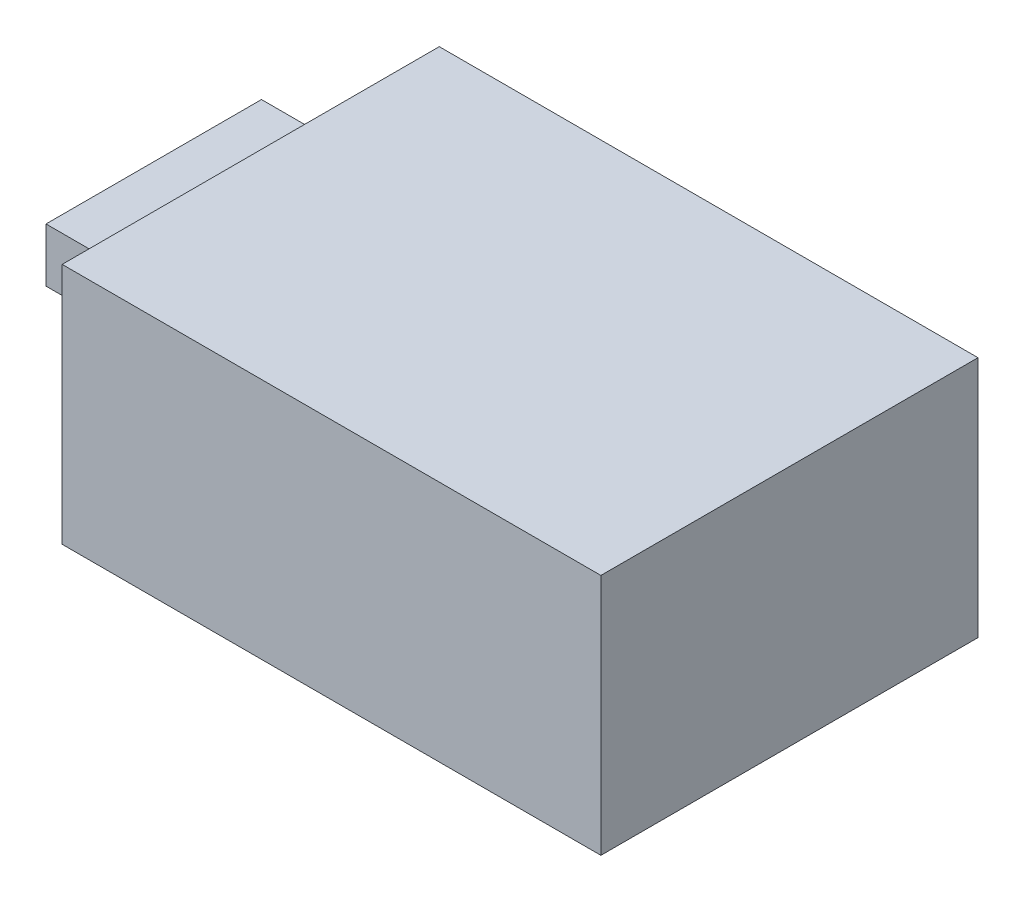
from build123d import *

# Parameters (mm, degrees)
ESQUISSE1_W             = 100
ESQUISSE1_H             = 70
BOSS_EXTRU_1_DEPTH      = 45
ESQUISSE2_W             = 0.269230769
ESQUISSE2_H             = 2.557692308
ESQUISSE2_H_2           = 3.58974359
ESQUISSE2_W_2           = 1.032051282
ESQUISSE2_H_3           = 0.358974359
ENL_V_MAT_EXTRU_1_DEPTH = 1
ESQUISSE4_W             = 40
ESQUISSE4_H             = 10
BOSS_EXTRU_3_DEPTH      = 10


with BuildPart() as part:
    # Esquisse1 → Boss.-Extru.1 (new body)
    with BuildSketch(Plane(origin=(0, 0, 0), x_dir=(1, 0, 0), z_dir=(0, 1, 0))):
        with Locations((50, 35)):
            Rectangle(ESQUISSE1_W, ESQUISSE1_H)
    extrude(amount=BOSS_EXTRU_1_DEPTH)

    # Esquisse2 → Enlèv. mat.-Extru.1 (cut)
    # profile 1 of 38: a face of its own
    with BuildSketch(Plane(origin=(0, 0, 0), x_dir=(0, 0, -1), z_dir=(1, 0, 0))):
        with BuildLine():
            Line((91.026156626, 13.700619152), (90.496809671, 13.700619152))
            add(Edge.make_bspline(
                [(90.496809671, 13.700619152), (90.470857876, 13.700439906), (90.420539827, 13.700092365), (90.347570174, 13.694863297), (90.279166415, 13.687519786), (90.215516398, 13.676254829), (90.156285067, 13.662210806), (90.101488434, 13.645713573), (90.051380883, 13.625474449), (89.991460141, 13.593298017), (89.922792632, 13.545376836), (89.849195087, 13.474638855), (89.785613838, 13.389910017), (89.732010099, 13.292940613), (89.689230067, 13.187116456), (89.656905306, 13.074469001), (89.638907128, 12.955675346), (89.636402304, 12.874521149), (89.635130985, 12.833331492)],
                knots=[0, 0, 0, 0, 0.891715277, 1.728950727, 2.513064701, 3.255203921, 3.948766564, 4.604262281, 5.220282906, 5.802379559, 6.938782209, 8.086286308, 9.295947763, 10.565258933, 11.88380714, 13.211084805, 14.584491459, 16, 16, 16, 16], degree=3))
            add(Edge.make_bspline(
                [(89.635130985, 12.833331492), (89.63631318, 12.794728413), (89.638629908, 12.719078569), (89.653768027, 12.607915775), (89.681729097, 12.502690794), (89.718154035, 12.402749221), (89.766361915, 12.31081834), (89.822851656, 12.226106133), (89.891724338, 12.151942189), (89.944019581, 12.109861139), (89.970267203, 12.088740146)],
                knots=[0, 0, 0, 0, 1.093252413, 2.142429505, 3.168133804, 4.171213616, 5.148013088, 6.100683043, 7.046709601, 8, 8, 8, 8], degree=3))
            add(Edge.make_bspline(
                [(89.970267203, 12.088740146), (89.937269857, 12.073402738), (89.873657816, 12.043835395), (89.786528019, 11.992354853), (89.711892212, 11.935672908), (89.648399126, 11.874629524), (89.594706203, 11.808128093), (89.546814716, 11.736660698), (89.506799294, 11.658001766), (89.472071304, 11.57371197), (89.445463617, 11.484332875), (89.424164398, 11.391048148), (89.413614138, 11.293677487), (89.411726518, 11.227548153), (89.41077201, 11.194108735)],
                knots=[0, 0, 0, 0, 1.163768338, 2.243504052, 3.230533254, 4.155935319, 5.053987392, 5.960250928, 6.903337148, 7.872532169, 8.873063681, 9.883603536, 10.929808265, 12, 12, 12, 12], degree=3))
            add(Edge.make_bspline(
                [(89.41077201, 11.194108735), (89.411370671, 11.15995617), (89.412546787, 11.092860704), (89.424024268, 10.994343605), (89.442948529, 10.900106419), (89.469095791, 10.809862779), (89.501858796, 10.722959249), (89.543297891, 10.640455731), (89.592293705, 10.562162733), (89.646865622, 10.488069219), (89.708573344, 10.421034066), (89.775054445, 10.361260524), (89.848184618, 10.312239047), (89.925555873, 10.27112089), (90.008217102, 10.239398742), (90.096019617, 10.21725483), (90.18875419, 10.202515227), (90.252526903, 10.201259808), (90.285070889, 10.200619152)],
                knots=[0, 0, 0, 0, 1.104921977, 2.170708223, 3.20458976, 4.212356697, 5.208275033, 6.206115799, 7.194654298, 8.19455684, 9.179558932, 10.138696175, 11.080620748, 12.021177812, 12.96930719, 13.937910956, 14.947691074, 16, 16, 16, 16], degree=3))
            Line((90.285070889, 10.200619152), (91.026156626, 10.200619152))
            Line((91.026156626, 10.200619152), (91.026156626, 13.700619152))
        make_face()
        with BuildLine():
            Line((90.756925856, 13.341644793), (90.756925856, 12.219849921))
            Line((90.756925856, 12.219849921), (90.602679062, 12.219849921))
            add(Edge.make_bspline(
                [(90.602679062, 12.219849921), (90.580010199, 12.220249065), (90.536292082, 12.221018835), (90.473079175, 12.223232888), (90.414698957, 12.229415375), (90.360726931, 12.235724048), (90.311361719, 12.245732345), (90.266742528, 12.257699659), (90.226241274, 12.270455744), (90.179695667, 12.292375313), (90.126449609, 12.324929886), (90.070195076, 12.374380057), (90.02127975, 12.433834414), (89.979525342, 12.501522816), (89.946128288, 12.576579464), (89.921473432, 12.656302197), (89.907213849, 12.740508857), (89.905326615, 12.797754296), (89.904361754, 12.827021396)],
                knots=[0, 0, 0, 0, 1.024514038, 1.975830262, 2.856351832, 3.676281358, 4.430102987, 5.129362982, 5.763827713, 6.344998159, 7.44979292, 8.572310383, 9.712079399, 10.916493527, 12.154869752, 13.414140029, 14.677962405, 16, 16, 16, 16], degree=3))
            add(Edge.make_bspline(
                [(89.904361754, 12.827021396), (89.904732233, 12.846439528), (89.905457388, 12.88444739), (89.912079298, 12.939719834), (89.921643658, 12.992095856), (89.935603034, 13.041216368), (89.953817592, 13.087094514), (89.976521071, 13.129576712), (90.003145201, 13.168771819), (90.033501634, 13.204906674), (90.068091786, 13.237765865), (90.108123681, 13.265681455), (90.152990488, 13.288569043), (90.201703041, 13.308939083), (90.256120474, 13.322830788), (90.314797788, 13.334413738), (90.378427984, 13.340478417), (90.422246478, 13.341246986), (90.444926658, 13.341644793)],
                knots=[0, 0, 0, 0, 1.090741261, 2.134950166, 3.124022964, 4.080111436, 4.9995072, 5.892543391, 6.781320552, 7.657393263, 8.540036488, 9.454541814, 10.388547584, 11.366484684, 12.414650189, 13.537646264, 14.725501027, 16, 16, 16, 16], degree=3))
            Line((90.444926658, 13.341644793), (90.756925856, 13.341644793))
        make_face(mode=Mode.SUBTRACT)
        with BuildLine():
            Line((90.756925856, 11.860875562), (90.756925856, 10.559593511))
            Line((90.756925856, 10.559593511), (90.421088517, 10.559593511))
            add(Edge.make_bspline(
                [(90.421088517, 10.559593511), (90.397249011, 10.559977783), (90.351190641, 10.560720203), (90.284506146, 10.563143887), (90.222464157, 10.568643452), (90.165706556, 10.577227969), (90.113569826, 10.586684178), (90.066765563, 10.599364295), (90.024481464, 10.613902185), (89.974836963, 10.636303513), (89.918987542, 10.671619862), (89.859742802, 10.724426087), (89.806343903, 10.786474584), (89.762524465, 10.859050709), (89.725148019, 10.936959329), (89.699543357, 11.02017909), (89.682368983, 11.105992231), (89.680795798, 11.16457703), (89.68000278, 11.194108735)],
                knots=[0, 0, 0, 0, 1.025658285, 1.981590913, 2.869950826, 3.703121919, 4.450405073, 5.1478774, 5.786969539, 6.37189212, 7.487654004, 8.613111877, 9.775546434, 10.994680776, 12.249481904, 13.483162395, 14.731300493, 16, 16, 16, 16], degree=3))
            add(Edge.make_bspline(
                [(89.68000278, 11.194108735), (89.681561818, 11.230662531), (89.684608791, 11.302102975), (89.706213979, 11.40591463), (89.745040505, 11.501611906), (89.796916333, 11.58937049), (89.861185975, 11.667968161), (89.93881705, 11.732745491), (90.027094258, 11.785672413), (90.092451442, 11.808050922), (90.125916241, 11.819509376)],
                knots=[0, 0, 0, 0, 1.062063652, 2.075688636, 3.063130913, 4.049638598, 5.02873165, 5.997406003, 6.974613008, 8, 8, 8, 8], degree=3))
            add(Edge.make_bspline(
                [(90.125916241, 11.819509376), (90.138497522, 11.822945483), (90.165321184, 11.830271365), (90.209393839, 11.838466906), (90.259702392, 11.845387349), (90.316578432, 11.850604146), (90.379638467, 11.85599231), (90.449127592, 11.858107241), (90.524837245, 11.860600748), (90.577435775, 11.860781557), (90.604782427, 11.860875562)],
                knots=[0, 0, 0, 0, 0.649213929, 1.384143309, 2.230102551, 3.177344616, 4.227903002, 5.380977667, 6.638336617, 8, 8, 8, 8], degree=3))
            Line((90.604782427, 11.860875562), (90.756925856, 11.860875562))
        make_face(mode=Mode.SUBTRACT)
    # profile 2 of 38: a face of its own
    with BuildSketch(Plane(origin=(0, 0, 0), x_dir=(0, 0, -1), z_dir=(1, 0, 0))):
        with BuildLine():
            Line((86.942823292, 12.75831146), (86.942823292, 10.200619152))
            Line((86.942823292, 10.200619152), (87.212054062, 10.200619152))
            Line((87.212054062, 10.200619152), (87.212054062, 10.643027005))
            add(Edge.make_bspline(
                [(87.212054062, 10.643027005), (87.238278934, 10.603110741), (87.28891423, 10.526039946), (87.376618494, 10.424966738), (87.467980339, 10.339141555), (87.565539453, 10.271379502), (87.667778675, 10.21930756), (87.774554046, 10.183084821), (87.885712906, 10.159221402), (87.961662925, 10.156915029), (88.000114959, 10.155747357)],
                knots=[0, 0, 0, 0, 1.179334017, 2.277072125, 3.299058578, 4.27014761, 5.202761405, 6.125302315, 7.050876602, 8, 8, 8, 8], degree=3))
            add(Edge.make_bspline(
                [(88.000114959, 10.155747357), (88.034318698, 10.156983558), (88.102048071, 10.159431452), (88.201462099, 10.17826702), (88.296896857, 10.208456765), (88.388475309, 10.251247873), (88.476194538, 10.306199231), (88.560021071, 10.373394746), (88.639640769, 10.452810057), (88.714410193, 10.543037202), (88.782336233, 10.642141081), (88.843345116, 10.74669286), (88.8937495, 10.857481317), (88.935138603, 10.973374834), (88.967348992, 11.094398345), (88.990675107, 11.220465828), (89.003816803, 11.351814965), (89.00587842, 11.441109202), (89.006925856, 11.486476524)],
                knots=[0, 0, 0, 0, 0.887872522, 1.758142578, 2.618128085, 3.481683386, 4.376005731, 5.300250685, 6.265959025, 7.291808604, 8.339055305, 9.383289759, 10.431679196, 11.495297482, 12.575994128, 13.680797244, 14.821693069, 16, 16, 16, 16], degree=3))
            add(Edge.make_bspline(
                [(89.006925856, 11.486476524), (89.005950926, 11.530916994), (89.004026934, 11.618618689), (88.989775776, 11.747552378), (88.966549398, 11.871756308), (88.934707704, 11.991127072), (88.892226306, 12.105223371), (88.84073311, 12.214440192), (88.780564909, 12.319030097), (88.711532634, 12.417314369), (88.635938758, 12.506921026), (88.55579686, 12.586237663), (88.471599708, 12.653388353), (88.383040965, 12.707624536), (88.291461637, 12.751315307), (88.195410797, 12.781433836), (88.095434863, 12.799340753), (88.027531733, 12.801890494), (87.993103741, 12.803183255)],
                knots=[0, 0, 0, 0, 1.159290559, 2.287818926, 3.379660878, 4.453494628, 5.506844558, 6.551511375, 7.600493292, 8.650980421, 9.680735975, 10.655174849, 11.588394672, 12.48356998, 13.359156398, 14.228863471, 15.102004974, 16, 16, 16, 16], degree=3))
            add(Edge.make_bspline(
                [(87.993103741, 12.803183255), (87.953737231, 12.801707888), (87.875942437, 12.798792318), (87.762293232, 12.77541971), (87.655111187, 12.735038451), (87.552925259, 12.68103499), (87.456809998, 12.608781442), (87.368017591, 12.517917518), (87.284233345, 12.409530819), (87.236807422, 12.327742583), (87.212054062, 12.285054248)],
                knots=[0, 0, 0, 0, 0.955142924, 1.887521798, 2.80119314, 3.727598216, 4.684104897, 5.707064902, 6.803231533, 8, 8, 8, 8], degree=3))
            Line((87.212054062, 12.285054248), (87.212054062, 12.75831146))
            Line((87.212054062, 12.75831146), (86.942823292, 12.75831146))
        make_face()
        with BuildLine():
            add(Edge.make_bspline(
                [(87.974173453, 12.489080691), (88.008206386, 12.487435132), (88.075767721, 12.484168409), (88.174778166, 12.458652163), (88.269116182, 12.416322657), (88.358760938, 12.358763114), (88.441892431, 12.285988798), (88.516194937, 12.199045675), (88.582055694, 12.099025926), (88.636890146, 11.98709029), (88.681734992, 11.867095119), (88.713665243, 11.742039573), (88.7343568, 11.613599707), (88.736576199, 11.526753569), (88.737695087, 11.482970915)],
                knots=[0, 0, 0, 0, 0.876143593, 1.739298532, 2.615462818, 3.5308531, 4.474045836, 5.451821009, 6.468949931, 7.55154866, 8.656673038, 9.763764415, 10.872623107, 12, 12, 12, 12], degree=3))
            add(Edge.make_bspline(
                [(88.737695087, 11.482970915), (88.736545339, 11.439428173), (88.734258663, 11.3528282), (88.713894024, 11.224480769), (88.680678206, 11.09917133), (88.635763801, 10.978243867), (88.579612901, 10.865621433), (88.514373509, 10.764188476), (88.439569428, 10.676210221), (88.356034151, 10.602632135), (88.266896616, 10.543225002), (88.172738409, 10.501400123), (88.075445505, 10.474573316), (88.008932355, 10.471427542), (87.975575696, 10.469849921)],
                knots=[0, 0, 0, 0, 1.119778423, 2.227071088, 3.334118807, 4.451051948, 5.540186051, 6.565939309, 7.546896586, 8.501209795, 9.421850429, 10.291284033, 11.143070857, 12, 12, 12, 12], degree=3))
            add(Edge.make_bspline(
                [(87.975575696, 10.469849921), (87.942003186, 10.471504973), (87.874896499, 10.474813188), (87.775877766, 10.500729169), (87.679705299, 10.542331609), (87.588365799, 10.601360021), (87.502308454, 10.672498633), (87.426813093, 10.758148779), (87.361215101, 10.854562589), (87.307481939, 10.962540348), (87.264877776, 11.079711849), (87.234189816, 11.204744861), (87.215620613, 11.337049426), (87.21326202, 11.427521098), (87.212054062, 11.473856332)],
                knots=[0, 0, 0, 0, 0.862570292, 1.724155687, 2.61524019, 3.547403977, 4.511725999, 5.478125195, 6.473421915, 7.502977832, 8.571655993, 9.673787814, 10.808626144, 12, 12, 12, 12], degree=3))
            add(Edge.make_bspline(
                [(87.212054062, 11.473856332), (87.212683911, 11.509175826), (87.213921478, 11.578573708), (87.224950795, 11.680439846), (87.241358893, 11.778019733), (87.265099752, 11.871287211), (87.297033792, 11.959691556), (87.334754836, 12.043977765), (87.379113143, 12.12404238), (87.430606864, 12.198255365), (87.487170033, 12.265816763), (87.546439166, 12.326151762), (87.610047969, 12.3761762), (87.676634311, 12.41725578), (87.746246174, 12.450228736), (87.819858171, 12.472055459), (87.895966612, 12.487143499), (87.947923174, 12.488430468), (87.974173453, 12.489080691)],
                knots=[0, 0, 0, 0, 1.20221804, 2.362190828, 3.48462824, 4.569282157, 5.633932456, 6.681042011, 7.71052723, 8.745747275, 9.751336919, 10.707874985, 11.620059176, 12.498976955, 13.367640915, 14.233493954, 15.107499117, 16, 16, 16, 16], degree=3))
        make_face(mode=Mode.SUBTRACT)
    # profile 3 of 38: a face of its own
    with BuildSketch(Plane(origin=(0, 0, 0), x_dir=(0, 0, -1), z_dir=(1, 0, 0))):
        Polygon((86.045387395, 13.790362742), (85.776156626, 13.790362742), (85.776156626, 12.75831146), (85.417182267, 12.75831146), (85.417182267, 12.444208896), (85.776156626, 12.444208896), (85.776156626, 10.200619152), (86.045387395, 10.200619152), (86.045387395, 12.444208896), (86.404361754, 12.444208896), (86.404361754, 12.75831146), (86.045387395, 12.75831146), align=None)
    # profile 4 of 38: a face of its own
    with BuildSketch(Plane(origin=(0, 0, 0), x_dir=(0, 0, -1), z_dir=(1, 0, 0))):
        Polygon((84.744105344, 13.790362742), (84.474874574, 13.790362742), (84.474874574, 12.75831146), (84.115900215, 12.75831146), (84.115900215, 12.444208896), (84.474874574, 12.444208896), (84.474874574, 10.200619152), (84.744105344, 10.200619152), (84.744105344, 12.444208896), (85.103079703, 12.444208896), (85.103079703, 12.75831146), (84.744105344, 12.75831146), align=None)
    # profile 5 of 38: a face of its own
    with BuildSketch(Plane(origin=(0, 0, 0), x_dir=(0, 0, -1), z_dir=(1, 0, 0))):
        with BuildLine():
            Line((81.999914639, 11.00831146), (81.782566882, 10.861777005))
            add(Edge.make_bspline(
                [(81.782566882, 10.861777005), (81.800648997, 10.822436699), (81.835615228, 10.74636251), (81.896475884, 10.640831582), (81.960363099, 10.546375273), (82.029838064, 10.464261111), (82.103287379, 10.392839245), (82.180916556, 10.330830788), (82.262540598, 10.276979501), (82.349180575, 10.232516586), (82.441133235, 10.197873756), (82.538733736, 10.173405536), (82.642143709, 10.158411669), (82.713137655, 10.156648363), (82.749413837, 10.155747357)],
                knots=[0, 0, 0, 0, 1.220827052, 2.360770422, 3.432396173, 4.43356285, 5.389352001, 6.318085998, 7.232386503, 8.143496222, 9.059435408, 9.998062091, 10.977058348, 12, 12, 12, 12], degree=3))
            add(Edge.make_bspline(
                [(82.749413837, 10.155747357), (82.7894579, 10.156897689), (82.867908572, 10.159151314), (82.982292977, 10.17866656), (83.090106118, 10.209823113), (83.19089528, 10.254675237), (83.284872794, 10.311981172), (83.372304794, 10.381898023), (83.452717888, 10.464660414), (83.524515025, 10.55915504), (83.589023147, 10.660865096), (83.645932317, 10.767026539), (83.694930724, 10.876394873), (83.732796713, 10.989902966), (83.764326426, 11.105614505), (83.785697669, 11.225036421), (83.799622557, 11.347555391), (83.801068451, 11.430581776), (83.801797651, 11.472454088)],
                knots=[0, 0, 0, 0, 1.021793171, 2.001803894, 2.953445749, 3.880428937, 4.809656477, 5.756478151, 6.731242877, 7.748128213, 8.781064043, 9.803553923, 10.821419221, 11.836639958, 12.855624059, 13.880896041, 14.931282125, 16, 16, 16, 16], degree=3))
            add(Edge.make_bspline(
                [(83.801797651, 11.472454088), (83.801180727, 11.511742463), (83.799958976, 11.589548813), (83.788510401, 11.704608055), (83.769364574, 11.816488096), (83.743757604, 11.925356729), (83.709833347, 12.030690292), (83.668997206, 12.132888393), (83.620977028, 12.232106849), (83.582635935, 12.294928887), (83.563416241, 12.326420434)],
                knots=[0, 0, 0, 0, 1.048900473, 2.077233192, 3.083708021, 4.078193164, 5.06105756, 6.035665036, 7.01531453, 8, 8, 8, 8], degree=3))
            add(Edge.make_bspline(
                [(83.563416241, 12.326420434), (83.537716447, 12.364096219), (83.48773664, 12.437366399), (83.402946391, 12.535872063), (83.309892517, 12.61772569), (83.211550731, 12.68616463), (83.10565949, 12.73812285), (82.994044374, 12.776928948), (82.875271967, 12.798465126), (82.794132652, 12.801594001), (82.752919446, 12.803183255)],
                knots=[0, 0, 0, 0, 1.111002694, 2.160628283, 3.157224189, 4.124064232, 5.071603655, 6.022611646, 6.995622377, 8, 8, 8, 8], degree=3))
            add(Edge.make_bspline(
                [(82.752919446, 12.803183255), (82.710262024, 12.801841937), (82.626585763, 12.799210826), (82.504686033, 12.774280497), (82.389459004, 12.735116497), (82.280836303, 12.679647256), (82.1790855, 12.607940866), (82.084292452, 12.520196709), (81.995867994, 12.417057812), (81.944858583, 12.339649499), (81.91858451, 12.299777806)],
                knots=[0, 0, 0, 0, 1.000931688, 1.963414985, 2.909556389, 3.852315515, 4.817877967, 5.824154561, 6.879259348, 8, 8, 8, 8], degree=3))
            add(Edge.make_bspline(
                [(81.91858451, 12.299777806), (81.900826521, 12.269413724), (81.865064356, 12.208264611), (81.819340831, 12.110794051), (81.781058596, 12.00775343), (81.74932153, 11.8992856), (81.725099392, 11.78531978), (81.706810019, 11.665963197), (81.695432634, 11.540913487), (81.693704723, 11.455651105), (81.692823292, 11.412157614)],
                knots=[0, 0, 0, 0, 0.909842459, 1.832298384, 2.781425176, 3.751643499, 4.753898402, 5.793881984, 6.874629437, 8, 8, 8, 8], degree=3))
            Line((81.692823292, 11.412157614), (83.532566882, 11.412157614))
            add(Edge.make_bspline(
                [(83.532566882, 11.412157614), (83.531472355, 11.378464574), (83.529322224, 11.312276664), (83.516934205, 11.21554415), (83.499152947, 11.123272619), (83.473715556, 11.036090232), (83.442028835, 10.953550588), (83.404240183, 10.875540666), (83.359730192, 10.802017851), (83.309097366, 10.733844115), (83.253030337, 10.672517579), (83.194182516, 10.61787222), (83.131390137, 10.571927474), (83.065206593, 10.534653152), (82.995861574, 10.505397324), (82.923221037, 10.48545941), (82.847592701, 10.472089479), (82.795980277, 10.470604643), (82.769746369, 10.469849921)],
                knots=[0, 0, 0, 0, 1.199307391, 2.355965805, 3.466971799, 4.54108325, 5.583878082, 6.610723878, 7.622224514, 8.638775178, 9.628106183, 10.57603663, 11.492831415, 12.390519048, 13.274221942, 14.164361782, 15.066969552, 16, 16, 16, 16], degree=3))
            add(Edge.make_bspline(
                [(82.769746369, 10.469849921), (82.744233308, 10.470481023), (82.693192188, 10.471743598), (82.617277251, 10.483325376), (82.542530963, 10.502579), (82.469489968, 10.528219798), (82.399521122, 10.560346727), (82.334568748, 10.598037786), (82.274965926, 10.64056415), (82.219141143, 10.688969999), (82.164658495, 10.747705139), (82.111970946, 10.821618648), (82.054206892, 10.908541238), (82.018783364, 10.973637325), (81.999914639, 11.00831146)],
                knots=[0, 0, 0, 0, 0.922983319, 1.846509136, 2.771776543, 3.713485408, 4.644573013, 5.554242718, 6.42743124, 7.290813438, 8.224586841, 9.319181914, 10.572033221, 12, 12, 12, 12], degree=3))
        make_face()
        with BuildLine():
            add(Edge.make_bspline(
                [(81.962054062, 11.726260178), (81.971181648, 11.767805057), (81.988639653, 11.847266453), (82.024532043, 11.958488706), (82.066089385, 12.056813951), (82.115451424, 12.142277123), (82.170712622, 12.218434533), (82.235142718, 12.284996073), (82.307149378, 12.344616973), (82.386827454, 12.394969743), (82.470683555, 12.43758632), (82.558879519, 12.466799631), (82.648768649, 12.486215395), (82.709817761, 12.488126491), (82.740299254, 12.489080691)],
                knots=[0, 0, 0, 0, 1.287691299, 2.462920814, 3.53458933, 4.514423943, 5.445998536, 6.37719655, 7.312528589, 8.270749586, 9.226771865, 10.15349307, 11.078049035, 12, 12, 12, 12], degree=3))
            add(Edge.make_bspline(
                [(82.740299254, 12.489080691), (82.765347156, 12.488474323), (82.81476917, 12.487277899), (82.887471344, 12.475746989), (82.957145835, 12.456584425), (83.024720944, 12.4307249), (83.088771588, 12.395788785), (83.151402396, 12.355171809), (83.210250022, 12.305755905), (83.246370279, 12.268329384), (83.264738356, 12.249297037)],
                knots=[0, 0, 0, 0, 1.010500647, 1.993818758, 2.961858883, 3.923627339, 4.906945451, 5.901198905, 6.932705779, 8, 8, 8, 8], degree=3))
            add(Edge.make_bspline(
                [(83.264738356, 12.249297037), (83.277861412, 12.234085898), (83.304799568, 12.202861461), (83.34090067, 12.150826147), (83.374693941, 12.09356668), (83.406341493, 12.030812183), (83.435524518, 11.962408438), (83.46209956, 11.888644265), (83.486098798, 11.809516859), (83.499636572, 11.754607066), (83.506625376, 11.726260178)],
                knots=[0, 0, 0, 0, 0.827595728, 1.698834691, 2.605819489, 3.566513017, 4.593589227, 5.669252772, 6.796764119, 8, 8, 8, 8], degree=3))
            Line((83.506625376, 11.726260178), (81.962054062, 11.726260178))
        make_face(mode=Mode.SUBTRACT)
    # profile 6 of 38: a face of its own
    with BuildSketch(Plane(origin=(0, 0, 0), x_dir=(0, 0, -1), z_dir=(1, 0, 0))):
        with BuildLine():
            Line((81.333848933, 12.75831146), (81.064618164, 12.75831146))
            Line((81.064618164, 12.75831146), (81.064618164, 12.381809056))
            add(Edge.make_bspline(
                [(81.064618164, 12.381809056), (81.04596148, 12.416682151), (81.010667882, 12.482652984), (80.952848785, 12.571946319), (80.892168228, 12.644964141), (80.830255318, 12.703621269), (80.765957608, 12.747950438), (80.700717185, 12.780127728), (80.633331176, 12.799313235), (80.587970269, 12.801898173), (80.565419446, 12.803183255)],
                knots=[0, 0, 0, 0, 1.379662333, 2.609962634, 3.70410508, 4.684907555, 5.576060405, 6.418504135, 7.213771616, 8, 8, 8, 8], degree=3))
            add(Edge.make_bspline(
                [(80.565419446, 12.803183255), (80.548015953, 12.801966467), (80.511822295, 12.79943594), (80.457251016, 12.782172592), (80.401122074, 12.754299882), (80.365496258, 12.72894308), (80.346669446, 12.71554303)],
                knots=[0, 0, 0, 0, 0.871477558, 1.812392457, 2.843937376, 4, 4, 4, 4], degree=3))
            Line((80.346669446, 12.71554303), (80.480583709, 12.443507774))
            add(Edge.make_bspline(
                [(80.480583709, 12.443507774), (80.492888494, 12.450209542), (80.515948432, 12.462769075), (80.549580859, 12.478087604), (80.580840711, 12.487134747), (80.600895685, 12.488459879), (80.610291241, 12.489080691)],
                knots=[0, 0, 0, 0, 1.210081042, 2.267767691, 3.188466361, 4, 4, 4, 4], degree=3))
            add(Edge.make_bspline(
                [(80.610291241, 12.489080691), (80.63063777, 12.487375612), (80.672613972, 12.483857926), (80.733616915, 12.456265599), (80.792366103, 12.412632208), (80.85009244, 12.35323273), (80.903425932, 12.275674845), (80.950087993, 12.179700426), (80.989764676, 12.065463385), (81.008900261, 11.982162198), (81.019045248, 11.93799896)],
                knots=[0, 0, 0, 0, 0.662811327, 1.36742251, 2.149178632, 3.045221645, 4.059512961, 5.209918752, 6.520801127, 8, 8, 8, 8], degree=3))
            add(Edge.make_bspline(
                [(81.019045248, 11.93799896), (81.022772788, 11.917699702), (81.03105134, 11.872616773), (81.039295384, 11.797389661), (81.04815156, 11.708405432), (81.053850622, 11.605474562), (81.058815176, 11.48884869), (81.06216188, 11.358420685), (81.064267417, 11.21398104), (81.064497698, 11.113013191), (81.064618164, 11.060194473)],
                knots=[0, 0, 0, 0, 0.562696875, 1.24970202, 2.062772353, 3.001466433, 4.060447458, 5.246391252, 6.559520794, 8, 8, 8, 8], degree=3))
            Line((81.064618164, 11.060194473), (81.064618164, 10.200619152))
            Line((81.064618164, 10.200619152), (81.333848933, 10.200619152))
            Line((81.333848933, 10.200619152), (81.333848933, 12.75831146))
        make_face()
    # profile 7 of 38: a face of its own
    with BuildSketch(Plane(origin=(0, 0, 0), x_dir=(0, 0, -1), z_dir=(1, 0, 0))):
        with BuildLine():
            add(Edge.make_bspline(
                [(80.033268004, 13.835234537), (80.018182839, 13.834333454), (79.988423907, 13.832555864), (79.945528949, 13.81683823), (79.906775436, 13.791090187), (79.872643171, 13.75643816), (79.843984451, 13.715267803), (79.822702175, 13.668813664), (79.810645806, 13.617787234), (79.80903564, 13.582659499), (79.808207908, 13.564601524)],
                knots=[0, 0, 0, 0, 0.925316671, 1.825398333, 2.770155624, 3.766109434, 4.798721319, 5.840692716, 6.88997351, 8, 8, 8, 8], degree=3))
            add(Edge.make_bspline(
                [(79.808207908, 13.564601524), (79.809053162, 13.547013123), (79.810707665, 13.512585516), (79.822680682, 13.462453847), (79.844181236, 13.416600586), (79.872623846, 13.375560062), (79.906780249, 13.340919668), (79.945527762, 13.315168732), (79.988424207, 13.299451816), (80.01818294, 13.297674129), (80.033268004, 13.296772998)],
                knots=[0, 0, 0, 0, 1.088952004, 2.131519058, 3.167636766, 4.207487879, 5.210423923, 6.161804529, 7.068196304, 8, 8, 8, 8], degree=3))
            add(Edge.make_bspline(
                [(80.033268004, 13.296772998), (80.048109389, 13.297707559), (80.07761379, 13.299565449), (80.120197169, 13.31497887), (80.158434206, 13.341167433), (80.192458364, 13.37555689), (80.22117356, 13.416414277), (80.241356252, 13.462751746), (80.254710177, 13.512446088), (80.256177475, 13.546985179), (80.256925856, 13.564601524)],
                knots=[0, 0, 0, 0, 0.92074776, 1.830429547, 2.773143394, 3.779719884, 4.823345439, 5.857221067, 6.907095329, 8, 8, 8, 8], degree=3))
            add(Edge.make_bspline(
                [(80.256925856, 13.564601524), (80.256197155, 13.582687665), (80.254777371, 13.617926231), (80.24133203, 13.668519062), (80.221368064, 13.715450169), (80.192440116, 13.756442177), (80.158438685, 13.79084218), (80.120196053, 13.817028148), (80.077614068, 13.832442216), (80.048109483, 13.834300019), (80.033268004, 13.835234537)],
                knots=[0, 0, 0, 0, 1.114023498, 2.170534419, 3.210371944, 4.246702081, 5.246242143, 6.18236599, 7.085688686, 8, 8, 8, 8], degree=3))
        make_face()
    # profile 8 of 38: a face of its own
    with BuildSketch(Plane(origin=(0, 0, 0), x_dir=(0, 0, -1), z_dir=(1, 0, 0))):
        with Locations((80.032566883, 11.479465306)):
            Rectangle(ESQUISSE2_W, ESQUISSE2_H)
    # profile 9 of 38: a face of its own
    with BuildSketch(Plane(origin=(0, 0, 0), x_dir=(0, 0, -1), z_dir=(1, 0, 0))):
        with BuildLine():
            Line((77.647350536, 11.00831146), (77.43000278, 10.861777005))
            add(Edge.make_bspline(
                [(77.43000278, 10.861777005), (77.448084894, 10.822436699), (77.483051126, 10.74636251), (77.543911781, 10.640831582), (77.607798996, 10.546375273), (77.677273962, 10.464261111), (77.750723276, 10.392839245), (77.828352453, 10.330830788), (77.909976496, 10.276979501), (77.996616472, 10.232516586), (78.088569133, 10.197873756), (78.186169634, 10.173405536), (78.289579606, 10.158411669), (78.360573552, 10.156648363), (78.396849735, 10.155747357)],
                knots=[0, 0, 0, 0, 1.220827052, 2.360770422, 3.432396173, 4.43356285, 5.389352001, 6.318085998, 7.232386503, 8.143496222, 9.059435408, 9.998062091, 10.977058348, 12, 12, 12, 12], degree=3))
            add(Edge.make_bspline(
                [(78.396849735, 10.155747357), (78.436893798, 10.156897689), (78.51534447, 10.159151314), (78.629728875, 10.17866656), (78.737542015, 10.209823113), (78.838331178, 10.254675237), (78.932308692, 10.311981172), (79.019740692, 10.381898023), (79.100153786, 10.464660414), (79.171950923, 10.55915504), (79.236459044, 10.660865096), (79.293368214, 10.767026539), (79.342366622, 10.876394873), (79.380232611, 10.989902966), (79.411762323, 11.105614505), (79.433133567, 11.225036421), (79.447058455, 11.347555391), (79.448504348, 11.430581776), (79.449233549, 11.472454088)],
                knots=[0, 0, 0, 0, 1.021793171, 2.001803894, 2.953445749, 3.880428937, 4.809656477, 5.756478151, 6.731242877, 7.748128213, 8.781064043, 9.803553923, 10.821419221, 11.836639958, 12.855624059, 13.880896041, 14.931282125, 16, 16, 16, 16], degree=3))
            add(Edge.make_bspline(
                [(79.449233549, 11.472454088), (79.448616625, 11.511742463), (79.447394874, 11.589548813), (79.435946299, 11.704608055), (79.416800472, 11.816488096), (79.391193502, 11.925356729), (79.357269245, 12.030690292), (79.316433103, 12.132888393), (79.268412925, 12.232106849), (79.230071833, 12.294928887), (79.210852139, 12.326420434)],
                knots=[0, 0, 0, 0, 1.048900473, 2.077233192, 3.083708021, 4.078193164, 5.06105756, 6.035665036, 7.01531453, 8, 8, 8, 8], degree=3))
            add(Edge.make_bspline(
                [(79.210852139, 12.326420434), (79.185152345, 12.364096219), (79.135172537, 12.437366399), (79.050382288, 12.535872063), (78.957328415, 12.61772569), (78.858986628, 12.68616463), (78.753095388, 12.73812285), (78.641480271, 12.776928948), (78.522707864, 12.798465126), (78.441568549, 12.801594001), (78.400355344, 12.803183255)],
                knots=[0, 0, 0, 0, 1.111002694, 2.160628283, 3.157224189, 4.124064232, 5.071603655, 6.022611646, 6.995622377, 8, 8, 8, 8], degree=3))
            add(Edge.make_bspline(
                [(78.400355344, 12.803183255), (78.357697922, 12.801841937), (78.27402166, 12.799210826), (78.15212193, 12.774280497), (78.036894901, 12.735116497), (77.928272201, 12.679647256), (77.826521397, 12.607940866), (77.73172835, 12.520196709), (77.643303892, 12.417057812), (77.59229448, 12.339649499), (77.566020408, 12.299777806)],
                knots=[0, 0, 0, 0, 1.000931688, 1.963414985, 2.909556389, 3.852315515, 4.817877967, 5.824154561, 6.879259348, 8, 8, 8, 8], degree=3))
            add(Edge.make_bspline(
                [(77.566020408, 12.299777806), (77.548262418, 12.269413724), (77.512500254, 12.208264611), (77.466776728, 12.110794051), (77.428494493, 12.00775343), (77.396757427, 11.8992856), (77.372535289, 11.78531978), (77.354245916, 11.665963197), (77.342868532, 11.540913487), (77.341140621, 11.455651105), (77.34025919, 11.412157614)],
                knots=[0, 0, 0, 0, 0.909842459, 1.832298384, 2.781425176, 3.751643499, 4.753898402, 5.793881984, 6.874629437, 8, 8, 8, 8], degree=3))
            Line((77.34025919, 11.412157614), (79.18000278, 11.412157614))
            add(Edge.make_bspline(
                [(79.18000278, 11.412157614), (79.178908252, 11.378464574), (79.176758121, 11.312276664), (79.164370102, 11.21554415), (79.146588844, 11.123272619), (79.121151453, 11.036090232), (79.089464733, 10.953550588), (79.05167608, 10.875540666), (79.00716609, 10.802017851), (78.956533264, 10.733844115), (78.900466235, 10.672517579), (78.841618413, 10.61787222), (78.778826034, 10.571927474), (78.71264249, 10.534653152), (78.643297472, 10.505397324), (78.570656934, 10.48545941), (78.495028599, 10.472089479), (78.443416174, 10.470604643), (78.417182267, 10.469849921)],
                knots=[0, 0, 0, 0, 1.199307391, 2.355965805, 3.466971799, 4.54108325, 5.583878082, 6.610723878, 7.622224514, 8.638775178, 9.628106183, 10.57603663, 11.492831415, 12.390519048, 13.274221942, 14.164361782, 15.066969552, 16, 16, 16, 16], degree=3))
            add(Edge.make_bspline(
                [(78.417182267, 10.469849921), (78.391669205, 10.470481023), (78.340628086, 10.471743598), (78.264713148, 10.483325376), (78.189966861, 10.502579), (78.116925866, 10.528219798), (78.046957019, 10.560346727), (77.982004646, 10.598037786), (77.922401823, 10.64056415), (77.86657704, 10.688969999), (77.812094392, 10.747705139), (77.759406844, 10.821618648), (77.70164279, 10.908541238), (77.666219262, 10.973637325), (77.647350536, 11.00831146)],
                knots=[0, 0, 0, 0, 0.922983319, 1.846509136, 2.771776543, 3.713485408, 4.644573013, 5.554242718, 6.42743124, 7.290813438, 8.224586841, 9.319181914, 10.572033221, 12, 12, 12, 12], degree=3))
        make_face()
        with BuildLine():
            add(Edge.make_bspline(
                [(77.609489959, 11.726260178), (77.618617545, 11.767805057), (77.63607555, 11.847266453), (77.67196794, 11.958488706), (77.713525283, 12.056813951), (77.762887322, 12.142277123), (77.818148519, 12.218434533), (77.882578615, 12.284996073), (77.954585276, 12.344616973), (78.034263352, 12.394969743), (78.118119453, 12.43758632), (78.206315416, 12.466799631), (78.296204546, 12.486215395), (78.357253658, 12.488126491), (78.387735151, 12.489080691)],
                knots=[0, 0, 0, 0, 1.287691299, 2.462920814, 3.53458933, 4.514423943, 5.445998536, 6.37719655, 7.312528589, 8.270749586, 9.226771865, 10.15349307, 11.078049035, 12, 12, 12, 12], degree=3))
            add(Edge.make_bspline(
                [(78.387735151, 12.489080691), (78.412783053, 12.488474323), (78.462205067, 12.487277899), (78.534907241, 12.475746989), (78.604581733, 12.456584425), (78.672156842, 12.4307249), (78.736207485, 12.395788785), (78.798838294, 12.355171809), (78.857685919, 12.305755905), (78.893806176, 12.268329384), (78.912174254, 12.249297037)],
                knots=[0, 0, 0, 0, 1.010500647, 1.993818758, 2.961858883, 3.923627339, 4.906945451, 5.901198905, 6.932705779, 8, 8, 8, 8], degree=3))
            add(Edge.make_bspline(
                [(78.912174254, 12.249297037), (78.92529731, 12.234085898), (78.952235466, 12.202861461), (78.988336567, 12.150826147), (79.022129838, 12.09356668), (79.053777391, 12.030812183), (79.082960416, 11.962408438), (79.109535458, 11.888644265), (79.133534696, 11.809516859), (79.147072469, 11.754607066), (79.154061273, 11.726260178)],
                knots=[0, 0, 0, 0, 0.827595728, 1.698834691, 2.605819489, 3.566513017, 4.593589227, 5.669252772, 6.796764119, 8, 8, 8, 8], degree=3))
            Line((79.154061273, 11.726260178), (77.609489959, 11.726260178))
        make_face(mode=Mode.SUBTRACT)
    # profile 10 of 38: a face of its own
    with BuildSketch(Plane(origin=(0, 0, 0), x_dir=(0, 0, -1), z_dir=(1, 0, 0))):
        with BuildLine():
            Line((75.814618164, 13.700619152), (75.271248773, 13.700619152))
            add(Edge.make_bspline(
                [(75.271248773, 13.700619152), (75.233853009, 13.700568564), (75.162321473, 13.700471796), (75.05971468, 13.697448531), (74.966439271, 13.693412424), (74.882752311, 13.687859359), (74.80853698, 13.681274294), (74.744063506, 13.671892914), (74.688521755, 13.662340103), (74.655364197, 13.652516238), (74.640239158, 13.648035017)],
                knots=[0, 0, 0, 0, 1.413289242, 2.703374391, 3.879342949, 4.941642004, 5.873291596, 6.693989754, 7.404254793, 8, 8, 8, 8], degree=3))
            add(Edge.make_bspline(
                [(74.640239158, 13.648035017), (74.620912826, 13.641427633), (74.582677872, 13.628355672), (74.528243333, 13.601663756), (74.476248808, 13.570965293), (74.426952172, 13.535022604), (74.380575256, 13.49389284), (74.336209767, 13.448619778), (74.295630979, 13.39740455), (74.257083122, 13.342371318), (74.222072335, 13.282989268), (74.191626357, 13.219482025), (74.166926114, 13.152135131), (74.145218386, 13.081381611), (74.129783945, 13.006657271), (74.117530409, 12.92831738), (74.110516851, 12.846314847), (74.109836622, 12.790342202), (74.109489959, 12.761817069)],
                knots=[0, 0, 0, 0, 0.884746594, 1.750370786, 2.622729615, 3.500310264, 4.390609716, 5.30783377, 6.244661446, 7.220040901, 8.219286538, 9.229974682, 10.268866035, 11.326756505, 12.435726026, 13.573575987, 14.763430443, 16, 16, 16, 16], degree=3))
            add(Edge.make_bspline(
                [(74.109489959, 12.761817069), (74.10979944, 12.733052981), (74.110404292, 12.67683634), (74.117893078, 12.594474861), (74.128591498, 12.515915764), (74.145029051, 12.441284436), (74.165147079, 12.370469288), (74.189754172, 12.30333556), (74.219038887, 12.240082022), (74.253647843, 12.181319607), (74.291525098, 12.126410783), (74.33280506, 12.075770452), (74.377868211, 12.030004591), (74.426394316, 11.989046739), (74.478636847, 11.953503831), (74.533572804, 11.921312216), (74.592548749, 11.894926654), (74.633584493, 11.880676251), (74.654261594, 11.873495755)],
                knots=[0, 0, 0, 0, 1.230348438, 2.404597596, 3.535952481, 4.620603023, 5.671397407, 6.683805958, 7.676968664, 8.649426021, 9.598095933, 10.528942615, 11.441124898, 12.342499997, 13.24120863, 14.141695784, 15.06363722, 16, 16, 16, 16], degree=3))
            add(Edge.make_bspline(
                [(74.654261594, 11.873495755), (74.671506022, 11.868844162), (74.70898031, 11.858735672), (74.770838584, 11.847205344), (74.842673289, 11.837470969), (74.924582222, 11.830171799), (75.016682836, 11.823892856), (75.118826316, 11.818966824), (75.231035644, 11.816218635), (75.309107838, 11.816077357), (75.349774414, 11.816003767)],
                knots=[0, 0, 0, 0, 0.612409215, 1.330841357, 2.156118473, 3.098102871, 4.150647915, 5.322299054, 6.605227774, 8, 8, 8, 8], degree=3))
            Line((75.349774414, 11.816003767), (75.545387395, 11.816003767))
            Line((75.545387395, 11.816003767), (75.545387395, 10.200619152))
            Line((75.545387395, 10.200619152), (75.814618164, 10.200619152))
            Line((75.814618164, 10.200619152), (75.814618164, 13.700619152))
        make_face()
        with BuildLine():
            Line((75.545387395, 13.341644793), (75.545387395, 12.174978126))
            Line((75.545387395, 12.174978126), (75.077038036, 12.167265787))
            add(Edge.make_bspline(
                [(75.077038036, 12.167265787), (75.054127252, 12.167246388), (75.009911189, 12.167208951), (74.945878434, 12.171258053), (74.886663101, 12.175698393), (74.832121098, 12.182695744), (74.782604003, 12.191967247), (74.737338235, 12.20185483), (74.697468479, 12.215490837), (74.650295747, 12.23482427), (74.597806195, 12.266751564), (74.541276859, 12.314004588), (74.493836945, 12.372844401), (74.452227536, 12.439214904), (74.420083292, 12.513149476), (74.395660819, 12.591808356), (74.381667188, 12.674847994), (74.379712315, 12.731618599), (74.378720728, 12.760414825)],
                knots=[0, 0, 0, 0, 1.042081371, 2.011137451, 2.917996092, 3.743607318, 4.511095698, 5.210044043, 5.848905295, 6.425539579, 7.526959198, 8.628378818, 9.761072847, 10.950155818, 12.183071426, 13.417453374, 14.690033403, 16, 16, 16, 16], degree=3))
            add(Edge.make_bspline(
                [(74.378720728, 12.760414825), (74.379716083, 12.788512667), (74.381686153, 12.844125729), (74.395781502, 12.925727896), (74.419998612, 13.003541092), (74.452568354, 13.076604001), (74.492614662, 13.142808247), (74.539410113, 13.199941053), (74.592209302, 13.247116106), (74.642580809, 13.276882348), (74.687099799, 13.2957563), (74.725350353, 13.308094186), (74.768457782, 13.318652629), (74.816534223, 13.326778439), (74.869363451, 13.333837918), (74.927389498, 13.338639365), (74.990070373, 13.341423106), (75.033565443, 13.341569348), (75.056004382, 13.341644793)],
                knots=[0, 0, 0, 0, 1.311348819, 2.595506256, 3.851552363, 5.106555753, 6.32083189, 7.452254181, 8.542153451, 9.608595853, 10.16582827, 10.797158969, 11.48245446, 12.235753575, 13.072011464, 13.969832696, 14.952644476, 16, 16, 16, 16], degree=3))
            Line((75.056004382, 13.341644793), (75.545387395, 13.341644793))
        make_face(mode=Mode.SUBTRACT)
    # profile 11 of 38: a face of its own
    with BuildSketch(Plane(origin=(0, 0, 0), x_dir=(0, 0, -1), z_dir=(1, 0, 0))):
        with Locations((73.481284831, 11.995490947)):
            Rectangle(ESQUISSE2_W, ESQUISSE2_H_2)
    # profile 12 of 38: a face of its own
    with BuildSketch(Plane(origin=(0, 0, 0), x_dir=(0, 0, -1), z_dir=(1, 0, 0))):
        with BuildLine():
            add(Edge.make_bspline(
                [(71.887634991, 12.803183255), (71.849441376, 12.802138891), (71.774124668, 12.800079436), (71.663975895, 12.778670255), (71.558770986, 12.745672413), (71.458109369, 12.700134181), (71.363790963, 12.63920419), (71.273532003, 12.566878852), (71.188725997, 12.480592641), (71.13862641, 12.415328519), (71.112895408, 12.381809056)],
                knots=[0, 0, 0, 0, 0.997600737, 1.967239891, 2.921995117, 3.876339565, 4.846055743, 5.850055787, 6.895794904, 8, 8, 8, 8], degree=3))
            add(Edge.make_bspline(
                [(71.112895408, 12.381809056), (71.090563594, 12.34946376), (71.045931214, 12.284818428), (70.989829069, 12.181344532), (70.940686456, 12.07435872), (70.901417377, 11.96237617), (70.871563223, 11.845928935), (70.849809674, 11.725269154), (70.836002701, 11.600380358), (70.83457353, 11.515492563), (70.833848933, 11.472454088)],
                knots=[0, 0, 0, 0, 0.974492422, 1.947621278, 2.915467704, 3.892853539, 4.88708504, 5.894700399, 6.932604111, 8, 8, 8, 8], degree=3))
            add(Edge.make_bspline(
                [(70.833848933, 11.472454088), (70.834897833, 11.429188649), (70.836966585, 11.343855912), (70.850188483, 11.217876054), (70.873603292, 11.096042986), (70.905635626, 10.978253036), (70.947250303, 10.864424498), (70.998555152, 10.755332596), (71.058541409, 10.649886351), (71.12717497, 10.550144241), (71.202543665, 10.458000553), (71.28448644, 10.377269335), (71.37166861, 10.308504627), (71.464975098, 10.252963568), (71.562959009, 10.208912383), (71.666406965, 10.177948425), (71.775252262, 10.15937485), (71.849700993, 10.156971792), (71.887634991, 10.155747357)],
                knots=[0, 0, 0, 0, 1.107894965, 2.185109244, 3.239066719, 4.281441704, 5.307577007, 6.338291467, 7.364845487, 8.410599108, 9.435040353, 10.408337498, 11.35046711, 12.27106388, 13.181883432, 14.094411748, 15.029042138, 16, 16, 16, 16], degree=3))
            add(Edge.make_bspline(
                [(71.887634991, 10.155747357), (71.925571168, 10.156964586), (72.000024175, 10.159353502), (72.10905987, 10.178067284), (72.212827694, 10.208756779), (72.310982779, 10.252988675), (72.404335744, 10.308467405), (72.491491676, 10.377501341), (72.574151377, 10.45773893), (72.649461245, 10.550181201), (72.71814035, 10.649876566), (72.778114527, 10.75533521), (72.829422602, 10.864423801), (72.871036415, 10.978253226), (72.903068984, 11.096042934), (72.926483729, 11.217876068), (72.939705645, 11.343855908), (72.941774394, 11.429188648), (72.942823292, 11.472454088)],
                knots=[0, 0, 0, 0, 0.97035087, 1.904396978, 2.822082662, 3.732332818, 4.652354079, 5.593894721, 6.570857939, 7.594658757, 8.639758628, 9.6656709, 10.695741012, 11.721234828, 12.762958176, 13.816256772, 14.892797633, 16, 16, 16, 16], degree=3))
            add(Edge.make_bspline(
                [(72.942823292, 11.472454088), (72.94209956, 11.515260709), (72.940668251, 11.599918412), (72.926767698, 11.724542696), (72.905480648, 11.845154951), (72.874174494, 11.960732928), (72.835893035, 12.07274053), (72.787170669, 12.179651399), (72.73052119, 12.282825222), (72.686074041, 12.347340932), (72.663776818, 12.379705691)],
                knots=[0, 0, 0, 0, 1.063876162, 2.104004247, 3.113779066, 4.10599887, 5.078075217, 6.053289624, 7.023419104, 8, 8, 8, 8], degree=3))
            add(Edge.make_bspline(
                [(72.663776818, 12.379705691), (72.638096532, 12.413507412), (72.588200412, 12.479183264), (72.502854098, 12.565350342), (72.41307398, 12.638872363), (72.317750565, 12.699025272), (72.217417811, 12.745892228), (72.111961691, 12.778602829), (72.001624832, 12.800141682), (71.926066361, 12.802157797), (71.887634991, 12.803183255)],
                knots=[0, 0, 0, 0, 1.105877608, 2.148691041, 3.153713737, 4.125868282, 5.080095171, 6.03217926, 6.999105637, 8, 8, 8, 8], degree=3))
        make_face()
        with BuildLine():
            add(Edge.make_bspline(
                [(71.888336113, 12.489080691), (71.914809286, 12.488113484), (71.967195164, 12.486199548), (72.044191356, 12.471629978), (72.118198414, 12.448586591), (72.189325426, 12.415759895), (72.257362301, 12.373331374), (72.322842042, 12.32197417), (72.384890041, 12.260688983), (72.443630123, 12.191547), (72.497333535, 12.115495504), (72.544239446, 12.034683881), (72.584617585, 11.950438375), (72.616680643, 11.861744311), (72.643191158, 11.76962502), (72.659790913, 11.672952936), (72.671956281, 11.573023111), (72.673040667, 11.504979077), (72.673592523, 11.470350723)],
                knots=[0, 0, 0, 0, 0.892051984, 1.765218143, 2.632427219, 3.499707879, 4.398381485, 5.329923715, 6.299412897, 7.333506008, 8.385012576, 9.433681383, 10.480424421, 11.529892124, 12.610027243, 13.707297798, 14.833218744, 16, 16, 16, 16], degree=3))
            add(Edge.make_bspline(
                [(72.673592523, 11.470350723), (72.67255896, 11.425621765), (72.670513198, 11.337088491), (72.648792254, 11.207135721), (72.617340633, 11.081251501), (72.570952585, 10.962223916), (72.513952625, 10.85191424), (72.447663112, 10.752595778), (72.370353897, 10.667933013), (72.285362484, 10.596307028), (72.192948185, 10.540289888), (72.095371579, 10.49975272), (71.993446858, 10.473815907), (71.923545509, 10.471178424), (71.888336113, 10.469849921)],
                knots=[0, 0, 0, 0, 1.139368929, 2.255184748, 3.350673064, 4.442866719, 5.503577089, 6.511720108, 7.47770502, 8.416871705, 9.336594054, 10.220769263, 11.103799257, 12, 12, 12, 12], degree=3))
            add(Edge.make_bspline(
                [(71.888336113, 10.469849921), (71.853124323, 10.471174885), (71.783218224, 10.473805339), (71.681328751, 10.499794289), (71.583801778, 10.540054628), (71.491912352, 10.596801158), (71.406298485, 10.667416084), (71.329795903, 10.752898641), (71.26338528, 10.851868333), (71.206372767, 10.96222172), (71.160248002, 11.081365796), (71.127648803, 11.207015116), (71.106221182, 11.337104535), (71.104134128, 11.425627151), (71.103079703, 11.470350723)],
                knots=[0, 0, 0, 0, 0.896424748, 1.779675456, 2.664071664, 3.578931997, 4.522916774, 5.48514584, 6.493540845, 7.554516339, 8.646982988, 9.744251569, 10.860346286, 12, 12, 12, 12], degree=3))
            add(Edge.make_bspline(
                [(71.103079703, 11.470350723), (71.103661481, 11.504972692), (71.104804663, 11.573004181), (71.116549481, 11.673067343), (71.134707412, 11.7693872), (71.159512992, 11.862040711), (71.193012438, 11.950269073), (71.233096865, 12.034680347), (71.279963452, 12.115723145), (71.334519403, 12.191327652), (71.393150645, 12.260706432), (71.455218639, 12.322008198), (71.520637342, 12.373065001), (71.588289584, 12.416183724), (71.659556056, 12.44822955), (71.73335838, 12.471790268), (71.809959077, 12.486123691), (71.862101425, 12.488090911), (71.888336113, 12.489080691)],
                knots=[0, 0, 0, 0, 1.167383154, 2.293884921, 3.393164049, 4.471755392, 5.524513002, 6.571796016, 7.621005792, 8.677622853, 9.712249415, 10.68223872, 11.614261498, 12.506704025, 13.381600122, 14.241739258, 15.11535585, 16, 16, 16, 16], degree=3))
        make_face(mode=Mode.SUBTRACT)
    # profile 13 of 38: a face of its own
    with BuildSketch(Plane(origin=(0, 0, 0), x_dir=(0, 0, -1), z_dir=(1, 0, 0))):
        with BuildLine():
            Line((70.34025919, 12.75831146), (70.071028421, 12.75831146))
            Line((70.071028421, 12.75831146), (70.071028421, 12.313800242))
            add(Edge.make_bspline(
                [(70.071028421, 12.313800242), (70.049506822, 12.352552883), (70.008644767, 12.426130714), (69.940158844, 12.524104406), (69.872860991, 12.607594761), (69.822720185, 12.652314155), (69.798993164, 12.673475723)],
                knots=[0, 0, 0, 0, 1.171933473, 2.225095347, 3.16010125, 4, 4, 4, 4], degree=3))
            add(Edge.make_bspline(
                [(69.798993164, 12.673475723), (69.76702604, 12.693379078), (69.704580166, 12.732259097), (69.603585669, 12.773232006), (69.500108617, 12.79797872), (69.430101149, 12.801450049), (69.39514701, 12.803183255)],
                knots=[0, 0, 0, 0, 1.048657587, 2.048490186, 3.025627617, 4, 4, 4, 4], degree=3))
            add(Edge.make_bspline(
                [(69.39514701, 12.803183255), (69.371491142, 12.802109827), (69.324281172, 12.79996759), (69.254493245, 12.786692336), (69.187054786, 12.762859614), (69.122202879, 12.730645356), (69.061081431, 12.691058215), (69.005050365, 12.645013311), (68.954853901, 12.592985179), (68.910739125, 12.533050004), (68.869634303, 12.464441324), (68.834251655, 12.382934296), (68.799134162, 12.289399109), (68.780831137, 12.221444027), (68.771148613, 12.185494953)],
                knots=[0, 0, 0, 0, 0.894318559, 1.784789816, 2.673155522, 3.589665775, 4.515830902, 5.419523397, 6.325415028, 7.240562059, 8.226788069, 9.341658935, 10.593704917, 12, 12, 12, 12], degree=3))
            add(Edge.make_bspline(
                [(68.771148613, 12.185494953), (68.749717452, 12.233443135), (68.708546936, 12.325554403), (68.633021347, 12.450500626), (68.550239579, 12.557681619), (68.459553004, 12.646324684), (68.36230364, 12.715456467), (68.261034057, 12.766658421), (68.155006079, 12.797431442), (68.082837531, 12.801270826), (68.046889799, 12.803183255)],
                knots=[0, 0, 0, 0, 1.247522168, 2.39656325, 3.461211686, 4.459136641, 5.39944971, 6.286422375, 7.146453235, 8, 8, 8, 8], degree=3))
            add(Edge.make_bspline(
                [(68.046889799, 12.803183255), (68.013793163, 12.80154282), (67.948531104, 12.798308108), (67.853558353, 12.773194854), (67.765462289, 12.72990061), (67.68389152, 12.671448455), (67.610692582, 12.597860196), (67.547451551, 12.510569804), (67.493644561, 12.4104953), (67.458711829, 12.317012871), (67.435687033, 12.233879447), (67.42060171, 12.163131708), (67.407068542, 12.0850632), (67.397072293, 11.999597213), (67.388383744, 11.906813534), (67.383206749, 11.806468028), (67.37959686, 11.698709002), (67.379018788, 11.62436721), (67.378720728, 11.586035819)],
                knots=[0, 0, 0, 0, 1.021070567, 2.013412143, 3.007378834, 4.036575433, 5.097825748, 6.197552405, 7.353325105, 8.595615841, 9.269603917, 10.015462958, 10.828037795, 11.714963733, 12.671344109, 13.704781296, 14.81656166, 16, 16, 16, 16], degree=3))
            Line((67.378720728, 11.586035819), (67.378720728, 10.200619152))
            Line((67.378720728, 10.200619152), (67.647951498, 10.200619152))
            Line((67.647951498, 10.200619152), (67.647951498, 11.587438062))
            add(Edge.make_bspline(
                [(67.647951498, 11.587438062), (67.64807576, 11.62015826), (67.648314549, 11.683035166), (67.650397496, 11.773262293), (67.653830539, 11.855548054), (67.658608791, 11.929666395), (67.664822856, 11.995852258), (67.672437318, 12.054101338), (67.681192028, 12.104501476), (67.69510774, 12.16017852), (67.716749841, 12.221689787), (67.750939199, 12.288009675), (67.793873317, 12.346304509), (67.843316783, 12.397184444), (67.900320221, 12.437980017), (67.962833113, 12.46798062), (68.030908172, 12.486268394), (68.078092236, 12.48812765), (68.102278421, 12.489080691)],
                knots=[0, 0, 0, 0, 1.379909185, 2.651708276, 3.805941215, 4.852978562, 5.783702266, 6.608923511, 7.330047616, 7.939622565, 9.027610697, 10.072418919, 11.073883027, 12.070533896, 13.052455124, 14.013527241, 14.981749467, 16, 16, 16, 16], degree=3))
            add(Edge.make_bspline(
                [(68.102278421, 12.489080691), (68.132175302, 12.487602119), (68.192019545, 12.48464248), (68.278754797, 12.45601084), (68.3617569, 12.412008326), (68.438002409, 12.349486337), (68.508067687, 12.27392264), (68.568852858, 12.185386237), (68.618209669, 12.084750653), (68.651921727, 11.992402605), (68.672944579, 11.909237998), (68.68670872, 11.836165246), (68.69845682, 11.753337303), (68.708130188, 11.660720025), (68.715654975, 11.558306178), (68.721412298, 11.446104659), (68.723732288, 11.324058979), (68.724484146, 11.239448137), (68.724874574, 11.195510979)],
                knots=[0, 0, 0, 0, 0.898028184, 1.79757268, 2.72350492, 3.715183115, 4.751339907, 5.81945548, 6.937089224, 8.119533788, 8.773471509, 9.519018729, 10.358283575, 11.292740113, 12.323454074, 13.451218336, 14.676455408, 16, 16, 16, 16], degree=3))
            Line((68.724874574, 11.195510979), (68.724874574, 10.200619152))
            Line((68.724874574, 10.200619152), (68.994105344, 10.200619152))
            Line((68.994105344, 10.200619152), (68.994105344, 11.501200082))
            add(Edge.make_bspline(
                [(68.994105344, 11.501200082), (68.994230958, 11.537893087), (68.994472607, 11.608481102), (68.996540128, 11.709691884), (68.999991932, 11.801788443), (69.004695261, 11.884560862), (69.011183771, 11.957927664), (69.017695958, 12.022349806), (69.026610442, 12.077371979), (69.040447882, 12.137711952), (69.062114488, 12.203469626), (69.095514732, 12.274845539), (69.138882272, 12.336967022), (69.189379533, 12.390475111), (69.24625865, 12.43457307), (69.309351989, 12.466767092), (69.378431598, 12.485508318), (69.426116525, 12.487870853), (69.450535632, 12.489080691)],
                knots=[0, 0, 0, 0, 1.442659481, 2.775310106, 3.979909877, 5.066085876, 6.034440002, 6.875647806, 7.611320077, 8.224284655, 9.308126128, 10.327370997, 11.311251607, 12.273219661, 13.210514908, 14.126903344, 15.040800711, 16, 16, 16, 16], degree=3))
            add(Edge.make_bspline(
                [(69.450535632, 12.489080691), (69.47926064, 12.487555478), (69.536739314, 12.484503532), (69.620612202, 12.456376789), (69.701393374, 12.412977473), (69.778060989, 12.352975647), (69.848678173, 12.279132206), (69.908947035, 12.191504304), (69.960637903, 12.093051079), (69.994827002, 12.001741033), (70.016736117, 11.920671179), (70.031403523, 11.851388044), (70.044066591, 11.774444962), (70.053190911, 11.689654312), (70.062107176, 11.597392863), (70.067432907, 11.497517735), (70.069918125, 11.389734674), (70.070649159, 11.315403956), (70.071028421, 11.276841107)],
                knots=[0, 0, 0, 0, 0.91128202, 1.82347317, 2.784601502, 3.817986041, 4.906375212, 6.022042265, 7.189149255, 8.435921352, 9.113974711, 9.859010574, 10.687587681, 11.593060163, 12.570945671, 13.635620039, 14.773357369, 16, 16, 16, 16], degree=3))
            Line((70.071028421, 11.276841107), (70.071028421, 10.200619152))
            Line((70.071028421, 10.200619152), (70.34025919, 10.200619152))
            Line((70.34025919, 10.200619152), (70.34025919, 12.75831146))
        make_face()
    # profile 14 of 38: a face of its own
    with BuildSketch(Plane(origin=(0, 0, 0), x_dir=(0, 0, -1), z_dir=(1, 0, 0))):
        with BuildLine():
            Line((66.795387395, 10.200619152), (66.795387395, 13.790362742))
            Line((66.795387395, 13.790362742), (66.526156626, 13.790362742))
            Line((66.526156626, 13.790362742), (66.526156626, 12.294168832))
            add(Edge.make_bspline(
                [(66.526156626, 12.294168832), (66.499622452, 12.334717714), (66.448542156, 12.412777386), (66.361295726, 12.516687925), (66.270173169, 12.605307496), (66.173476353, 12.677763866), (66.07144667, 12.733843697), (65.964841138, 12.774121364), (65.853293704, 12.799065942), (65.777253297, 12.801800359), (65.73879685, 12.803183255)],
                knots=[0, 0, 0, 0, 1.183408433, 2.278150912, 3.308211732, 4.283751013, 5.221855129, 6.1437005, 7.061200657, 8, 8, 8, 8], degree=3))
            add(Edge.make_bspline(
                [(65.73879685, 12.803183255), (65.70459467, 12.801943911), (65.636868384, 12.799489793), (65.537431646, 12.780700012), (65.441879508, 12.750274281), (65.349979901, 12.70809024), (65.262641846, 12.652469487), (65.178881744, 12.585566219), (65.099218775, 12.506147655), (65.024652839, 12.415637897), (64.955588163, 12.317255745), (64.895902329, 12.211813503), (64.84437007, 12.101855198), (64.803136714, 11.98623599), (64.770747925, 11.865733382), (64.747615285, 11.740088416), (64.734352997, 11.608990964), (64.73232028, 11.519926277), (64.731284831, 11.474557453)],
                knots=[0, 0, 0, 0, 0.888664965, 1.759711752, 2.620464811, 3.49030315, 4.380275418, 5.305345277, 6.271915529, 7.298680698, 8.350324717, 9.392467512, 10.444339629, 11.50318869, 12.578982071, 13.684771244, 14.820641409, 16, 16, 16, 16], degree=3))
            add(Edge.make_bspline(
                [(64.731284831, 11.474557453), (64.732247011, 11.4298818), (64.734140943, 11.341943368), (64.748520938, 11.212564409), (64.771536027, 11.088080461), (64.803664479, 10.968330279), (64.845799254, 10.853868539), (64.897543565, 10.744529693), (64.957539139, 10.639662683), (65.027464516, 10.541840572), (65.102929987, 10.4519793), (65.183125703, 10.372700512), (65.267309398, 10.305540359), (65.355871539, 10.251306564), (65.44744999, 10.207615177), (65.543501061, 10.17749681), (65.643476934, 10.15958985), (65.711380072, 10.157040115), (65.745808068, 10.155747357)],
                knots=[0, 0, 0, 0, 1.163832864, 2.290859305, 3.387233713, 4.459638328, 5.517298712, 6.560575213, 7.60816107, 8.660761018, 9.6891461, 10.662288122, 11.594265949, 12.488249894, 13.36267102, 14.231220626, 15.103200089, 16, 16, 16, 16], degree=3))
            add(Edge.make_bspline(
                [(65.745808068, 10.155747357), (65.784944088, 10.15721483), (65.86228212, 10.160114753), (65.975417802, 10.183646555), (66.082230105, 10.223743214), (66.184259991, 10.278013054), (66.279531572, 10.350912027), (66.369308004, 10.441194718), (66.452840633, 10.549911073), (66.501082944, 10.63148089), (66.526156626, 10.673876364)],
                knots=[0, 0, 0, 0, 0.950756707, 1.878822988, 2.793721063, 3.716364242, 4.677569045, 5.69787768, 6.803484299, 8, 8, 8, 8], degree=3))
            Line((66.526156626, 10.673876364), (66.526156626, 10.200619152))
            Line((66.526156626, 10.200619152), (66.795387395, 10.200619152))
        make_face()
        with BuildLine():
            add(Edge.make_bspline(
                [(65.764037235, 10.469849921), (65.730001828, 10.471492003), (65.662435583, 10.474751822), (65.563461726, 10.500319508), (65.46916123, 10.542367969), (65.380074167, 10.600667193), (65.29627354, 10.672423616), (65.222811265, 10.760180224), (65.156950687, 10.859702423), (65.102038619, 10.971451209), (65.05629068, 11.090980885), (65.024685494, 11.215989618), (65.003789353, 11.34414832), (65.001614804, 11.430770949), (65.0005156, 11.474557453)],
                knots=[0, 0, 0, 0, 0.877142563, 1.741281662, 2.618444942, 3.529808426, 4.478626649, 5.453591758, 6.4718804, 7.550317954, 8.658819177, 9.767172848, 10.871337684, 12, 12, 12, 12], degree=3))
            add(Edge.make_bspline(
                [(65.0005156, 11.474557453), (65.001669892, 11.518332409), (65.003965609, 11.605394392), (65.024227161, 11.734231298), (65.057543588, 11.85975548), (65.102432999, 11.980696869), (65.158640081, 12.093274362), (65.223776089, 12.194989868), (65.299353341, 12.282526522), (65.382770852, 12.356080677), (65.471420696, 12.415910674), (65.565295842, 12.457359602), (65.661815064, 12.484317872), (65.727639425, 12.487493727), (65.760531626, 12.489080691)],
                knots=[0, 0, 0, 0, 1.12643722, 2.240318849, 3.348008215, 4.465588733, 5.5553541, 6.581701888, 7.567147922, 8.522014253, 9.438164137, 10.308101667, 11.15456436, 12, 12, 12, 12], degree=3))
            add(Edge.make_bspline(
                [(65.760531626, 12.489080691), (65.794117018, 12.487475384), (65.861533985, 12.484253003), (65.960620924, 12.457416237), (66.057404512, 12.415829251), (66.149136979, 12.356380927), (66.234903257, 12.284044164), (66.311600119, 12.199201338), (66.376186349, 12.101662414), (66.43080672, 11.993983432), (66.473031709, 11.876790106), (66.504235729, 11.752374833), (66.522515841, 11.620699651), (66.524925538, 11.530470346), (66.526156626, 11.484373158)],
                knots=[0, 0, 0, 0, 0.861814427, 1.729945957, 2.620249608, 3.559885628, 4.527229284, 5.496788823, 6.487852805, 7.52457425, 8.592315935, 9.6818256, 10.815669478, 12, 12, 12, 12], degree=3))
            add(Edge.make_bspline(
                [(66.526156626, 11.484373158), (66.52553458, 11.449051473), (66.524312347, 11.379649285), (66.513172315, 11.277814234), (66.49715468, 11.180063645), (66.471982095, 11.087217068), (66.441432968, 10.998370216), (66.403377913, 10.914279688), (66.359128338, 10.834169663), (66.307558909, 10.760015727), (66.251287887, 10.69239806), (66.19152387, 10.632794714), (66.128192473, 10.582724599), (66.06156863, 10.541682592), (65.991966569, 10.508699816), (65.918351963, 10.486875707), (65.842244217, 10.47178697), (65.790287561, 10.470500096), (65.764037235, 10.469849921)],
                knots=[0, 0, 0, 0, 1.202687674, 2.363113594, 3.485989475, 4.573080044, 5.635495296, 6.683013894, 7.712901271, 8.748525714, 9.754508181, 10.70580767, 11.618348197, 12.497609316, 13.366612611, 14.232803886, 15.10715047, 16, 16, 16, 16], degree=3))
        make_face(mode=Mode.SUBTRACT)
    # profile 15 of 38: a face of its own
    with BuildSketch(Plane(origin=(0, 0, 0), x_dir=(0, 0, -1), z_dir=(1, 0, 0))):
        with BuildLine():
            Line((62.667182267, 13.835234537), (62.397951498, 13.835234537))
            add(Edge.make_bspline(
                [(62.397951498, 13.835234537), (62.411592099, 13.795137622), (62.439358242, 13.7135183), (62.475599043, 13.587313501), (62.511809323, 13.456837442), (62.545380049, 13.321220159), (62.576906812, 13.180485333), (62.605932861, 13.034732881), (62.634585658, 12.884394243), (62.667752889, 12.67650726), (62.703775528, 12.411271917), (62.734628252, 12.08783091), (62.753134579, 11.759431768), (62.755657322, 11.538616754), (62.756925856, 11.427582293)],
                knots=[0, 0, 0, 0, 0.623685608, 1.269543966, 1.933385462, 2.617927548, 3.326895302, 4.057280171, 4.806624257, 5.58072922, 7.157437953, 8.747983063, 10.364758158, 12, 12, 12, 12], degree=3))
            add(Edge.make_bspline(
                [(62.756925856, 11.427582293), (62.756281697, 11.32496495), (62.755003028, 11.121267812), (62.73977971, 10.818786355), (62.719045436, 10.521486539), (62.687178975, 10.232098311), (62.648724821, 9.953979307), (62.602112019, 9.691477721), (62.550849027, 9.445729335), (62.508296391, 9.289214354), (62.487695087, 9.213439665)],
                knots=[0, 0, 0, 0, 1.10082532, 2.185156639, 3.248606067, 4.297744606, 5.307978857, 6.260213866, 7.157705213, 8, 8, 8, 8], degree=3))
            Line((62.487695087, 9.213439665), (62.756925856, 9.213439665))
            add(Edge.make_bspline(
                [(62.756925856, 9.213439665), (62.777033519, 9.286179321), (62.818751779, 9.43709552), (62.869326373, 9.675132872), (62.91570664, 9.931107428), (62.955453163, 10.20348998), (62.986308032, 10.488373118), (63.00980467, 10.781292077), (63.022986525, 11.080171324), (63.025093695, 11.281269488), (63.026156626, 11.382710498)],
                knots=[0, 0, 0, 0, 0.825935268, 1.713604619, 2.662509375, 3.673359041, 4.725998309, 5.798675101, 6.889574045, 8, 8, 8, 8], degree=3))
            add(Edge.make_bspline(
                [(63.026156626, 11.382710498), (63.025146253, 11.492343133), (63.023134975, 11.710581133), (63.004913762, 12.035403417), (62.976264157, 12.356013961), (62.936661312, 12.670855209), (62.885794519, 12.977989995), (62.823842706, 13.274449322), (62.753533162, 13.560118239), (62.695705574, 13.744358505), (62.667182267, 13.835234537)],
                knots=[0, 0, 0, 0, 1.057254562, 2.104602531, 3.136548131, 4.161164425, 5.164233813, 6.138066408, 7.081606102, 8, 8, 8, 8], degree=3))
        make_face()
    # profile 16 of 38: a face of its own
    with BuildSketch(Plane(origin=(0, 0, 0), x_dir=(0, 0, -1), z_dir=(1, 0, 0))):
        Polygon((60.737695087, 13.700619152), (59.571028421, 10.200619152), (59.864097331, 10.200619152), (60.237795248, 11.322414024), (61.282466722, 11.322414024), (61.656164639, 10.200619152), (61.949233549, 10.200619152), (60.782566882, 13.700619152), align=None)
        Polygon((60.760130985, 12.888720114), (61.162574895, 11.681388383), (60.357687074, 11.681388383), align=None, mode=Mode.SUBTRACT)
    # profile 17 of 38: a face of its own
    with BuildSketch(Plane(origin=(0, 0, 0), x_dir=(0, 0, -1), z_dir=(1, 0, 0))):
        with BuildLine():
            Line((56.43000278, 13.103263383), (56.639638196, 12.848055049))
            add(Edge.make_bspline(
                [(56.639638196, 12.848055049), (56.676478712, 12.893610383), (56.748251113, 12.982360923), (56.866374042, 13.100837106), (56.990491661, 13.201122808), (57.118563048, 13.283693613), (57.247878629, 13.349501487), (57.377164981, 13.396050206), (57.504851328, 13.426046613), (57.589971679, 13.429630425), (57.631725536, 13.431388383)],
                knots=[0, 0, 0, 0, 1.180897879, 2.300615913, 3.366389015, 4.392591617, 5.368437861, 6.285267508, 7.158876892, 8, 8, 8, 8], degree=3))
            add(Edge.make_bspline(
                [(57.631725536, 13.431388383), (57.657471406, 13.43099035), (57.708689701, 13.43019851), (57.78478119, 13.419458955), (57.859930816, 13.404510251), (57.934143333, 13.382256532), (58.007635472, 13.35444758), (58.080147723, 13.319672094), (58.151749787, 13.27911499), (58.221386794, 13.231923115), (58.289440004, 13.180676766), (58.353083377, 13.123358491), (58.413848502, 13.062535448), (58.469712688, 12.996190278), (58.522461711, 12.9261764), (58.571115322, 12.851540214), (58.615006491, 12.77206007), (58.66904334, 12.661407113), (58.725235846, 12.517019599), (58.772567893, 12.337527744), (58.802560376, 12.153312196), (58.806315608, 12.02879121), (58.808207908, 11.966043832)],
                knots=[0, 0, 0, 0, 0.742195851, 1.476508881, 2.213078346, 2.951281721, 3.708907221, 4.477997883, 5.269176095, 6.080806104, 6.903452709, 7.724910218, 8.549764533, 9.38205395, 10.224901256, 11.077722799, 11.950072611, 12.842695263, 14.629531552, 16.409024752, 18.190471412, 20, 20, 20, 20], degree=3))
            add(Edge.make_bspline(
                [(58.808207908, 11.966043832), (58.80761909, 11.933777387), (58.806444085, 11.869388716), (58.798511146, 11.773434034), (58.785914848, 11.678658921), (58.768484711, 11.584952292), (58.745186642, 11.492577967), (58.717159343, 11.401288284), (58.68410777, 11.311435229), (58.64645461, 11.22331944), (58.604106374, 11.138173737), (58.556733955, 11.057495051), (58.506759445, 10.980986225), (58.451933492, 10.909707235), (58.394411804, 10.842219987), (58.331317799, 10.780664777), (58.265531713, 10.722721344), (58.195570712, 10.670362722), (58.12269786, 10.623723803), (58.048481343, 10.581718748), (57.971773772, 10.547536095), (57.893436915, 10.519455636), (57.813700684, 10.496556931), (57.731926624, 10.481752496), (57.648837444, 10.471010022), (57.59273222, 10.47023902), (57.564417844, 10.469849921)],
                knots=[0, 0, 0, 0, 1.075648671, 2.146489633, 3.207621231, 4.262009588, 5.322110962, 6.381840063, 7.444229469, 8.512289095, 9.575021281, 10.611993966, 11.629793255, 12.619316909, 13.608073431, 14.583229653, 15.555112222, 16.529022636, 17.492908616, 18.438097579, 19.369212982, 20.288485365, 21.211020687, 22.130920189, 23.056739734, 24, 24, 24, 24], degree=3))
            add(Edge.make_bspline(
                [(57.564417844, 10.469849921), (57.530245099, 10.470804127), (57.463009266, 10.472681554), (57.364394209, 10.48717663), (57.269764705, 10.509976518), (57.179473976, 10.543487333), (57.092949118, 10.585587694), (57.010287252, 10.637055962), (56.932380007, 10.698549522), (56.858959972, 10.768545223), (56.791329931, 10.846134856), (56.730092964, 10.929870703), (56.676099428, 11.018983549), (56.62929761, 11.113622284), (56.591176616, 11.214086607), (56.559455612, 11.319958761), (56.534631912, 11.431232686), (56.524757205, 11.507879316), (56.519746369, 11.546772998)],
                knots=[0, 0, 0, 0, 0.992732885, 1.953229764, 2.890514293, 3.816609624, 4.746085783, 5.682705685, 6.640557555, 7.625359646, 8.626536552, 9.627713458, 10.636418116, 11.650913816, 12.691491505, 13.75510899, 14.860849082, 16, 16, 16, 16], degree=3))
            Line((56.519746369, 11.546772998), (57.372310472, 11.546772998))
            Line((57.372310472, 11.546772998), (57.372310472, 11.905747357))
            Line((57.372310472, 11.905747357), (56.2505156, 11.905747357))
            add(Edge.make_bspline(
                [(56.2505156, 11.905747357), (56.251800399, 11.838871552), (56.254311648, 11.708157101), (56.27172116, 11.517407583), (56.301348453, 11.337360362), (56.340871822, 11.167731904), (56.392079286, 11.008675888), (56.454259059, 10.8601527), (56.528466444, 10.722479924), (56.612691797, 10.59593087), (56.706588528, 10.482110754), (56.808482264, 10.382410352), (56.918568415, 10.298143248), (57.03674056, 10.229699425), (57.162360185, 10.175852334), (57.295739542, 10.138192908), (57.436717615, 10.115184728), (57.533245539, 10.112334344), (57.58264701, 10.110875562)],
                knots=[0, 0, 0, 0, 1.279979538, 2.501828927, 3.662287385, 4.770080211, 5.832462613, 6.856844025, 7.847542677, 8.821456207, 9.761900772, 10.666623651, 11.544302252, 12.408204966, 13.273981784, 14.15325484, 15.054864909, 16, 16, 16, 16], degree=3))
            add(Edge.make_bspline(
                [(57.58264701, 10.110875562), (57.612813171, 10.111447244), (57.672541815, 10.112579167), (57.761012599, 10.120610381), (57.847298657, 10.132788252), (57.931013479, 10.151447191), (58.012490636, 10.174182624), (58.091247643, 10.2033327), (58.167801631, 10.237053793), (58.242373484, 10.275382367), (58.313915479, 10.32003916), (58.383406702, 10.368954993), (58.450374432, 10.42332408), (58.514709387, 10.482865692), (58.576751176, 10.547734708), (58.636070671, 10.618011496), (58.693884715, 10.692791595), (58.729291417, 10.745871468), (58.747210312, 10.772734537)],
                knots=[0, 0, 0, 0, 1.032382545, 2.044105334, 3.038476821, 4.012827536, 4.97754274, 5.931586725, 6.884288403, 7.839538852, 8.798533035, 9.768407888, 10.746592774, 11.748528567, 12.766901797, 13.816738798, 14.895078446, 16, 16, 16, 16], degree=3))
            add(Edge.make_bspline(
                [(58.747210312, 10.772734537), (58.773613388, 10.815577908), (58.826459408, 10.901329341), (58.893138616, 11.036917954), (58.950609201, 11.177090218), (58.996508351, 11.322633043), (59.033284288, 11.472939755), (59.058960212, 11.628323583), (59.074867591, 11.788558469), (59.076574239, 11.897062698), (59.077438677, 11.952021396)],
                knots=[0, 0, 0, 0, 0.972045947, 1.945559608, 2.915893918, 3.89712903, 4.891732452, 5.90371772, 6.93820781, 8, 8, 8, 8], degree=3))
            add(Edge.make_bspline(
                [(59.077438677, 11.952021396), (59.076973232, 11.993172617), (59.076049104, 12.074877189), (59.066400673, 12.196291601), (59.051950334, 12.315417962), (59.031321075, 12.432363175), (59.005867484, 12.54722479), (58.972995721, 12.659801428), (58.935681971, 12.770559132), (58.891192052, 12.878176843), (58.842725626, 12.982055898), (58.789336656, 13.080772143), (58.730969645, 13.173311454), (58.668774696, 13.260435407), (58.60183658, 13.341344344), (58.530865407, 13.416509695), (58.455878173, 13.486395498), (58.375806757, 13.549189603), (58.292823422, 13.60593803), (58.206911693, 13.65543924), (58.117923737, 13.696911616), (58.026623303, 13.731348081), (57.932200893, 13.757395251), (57.835384863, 13.776068041), (57.735826068, 13.788756274), (57.668456892, 13.789824691), (57.634530023, 13.790362742)],
                knots=[0, 0, 0, 0, 1.139613768, 2.262670523, 3.371514243, 4.462374492, 5.550696422, 6.628397115, 7.709281568, 8.786379394, 9.852056274, 10.883259988, 11.892634097, 12.880693113, 13.846294527, 14.798787622, 15.742440682, 16.682668171, 17.614523987, 18.525044925, 19.425686334, 20.331084297, 21.224742707, 22.135010483, 23.060798158, 24, 24, 24, 24], degree=3))
            add(Edge.make_bspline(
                [(57.634530023, 13.790362742), (57.606935722, 13.789770425), (57.55187609, 13.78858856), (57.47014252, 13.780732581), (57.389621644, 13.76799151), (57.310138201, 13.750584151), (57.231940233, 13.72746671), (57.155032877, 13.699045654), (57.079156753, 13.666328387), (57.004591394, 13.627386052), (56.930858727, 13.583115712), (56.85759631, 13.533004329), (56.784710435, 13.476936082), (56.712446326, 13.414366136), (56.64087358, 13.345303667), (56.569624548, 13.270374354), (56.498425322, 13.189706837), (56.45311218, 13.132459264), (56.43000278, 13.103263383)],
                knots=[0, 0, 0, 0, 0.919647238, 1.834996262, 2.733959633, 3.635416665, 4.54488085, 5.449260826, 6.366695346, 7.296870797, 8.250651732, 9.231496765, 10.253508801, 11.31380595, 12.415577929, 13.567028811, 14.759200909, 16, 16, 16, 16], degree=3))
        make_face()
    # profile 18 of 38: a face of its own
    with BuildSketch(Plane(origin=(0, 0, 0), x_dir=(0, 0, -1), z_dir=(1, 0, 0))):
        Polygon((55.756925856, 10.200619152), (55.416881786, 13.700619152), (55.315219126, 13.700619152), (54.253720728, 10.82882428), (53.198532427, 13.700619152), (53.092663036, 13.700619152), (52.7505156, 10.200619152), (53.020447491, 10.200619152), (53.266541241, 12.713439665), (54.189217523, 10.200619152), (54.312614959, 10.200619152), (55.240900215, 12.713439665), (55.4848906, 10.200619152), align=None)
    # profile 19 of 38: a face of its own
    with BuildSketch(Plane(origin=(0, 0, 0), x_dir=(0, 0, -1), z_dir=(1, 0, 0))):
        with BuildLine():
            Line((51.987695087, 9.213439665), (52.256925856, 9.213439665))
            add(Edge.make_bspline(
                [(52.256925856, 9.213439665), (52.24170591, 9.253542881), (52.210724121, 9.335177159), (52.168552675, 9.461172742), (52.127488439, 9.591666471), (52.08985715, 9.727404068), (52.054085659, 9.867841462), (52.021172417, 10.013548998), (51.990555193, 10.163897425), (51.951741063, 10.371418827), (51.912471394, 10.636799461), (51.877932509, 10.960486459), (51.857279798, 11.289190525), (51.85448487, 11.510052265), (51.853079703, 11.621091908)],
                knots=[0, 0, 0, 0, 0.629152548, 1.280705626, 1.94863881, 2.635697447, 3.346606829, 4.074312692, 4.826658778, 5.597225387, 7.171003155, 8.760319519, 10.371230047, 12, 12, 12, 12], degree=3))
            add(Edge.make_bspline(
                [(51.853079703, 11.621091908), (51.853862176, 11.723948041), (51.85541211, 11.92768702), (51.872670295, 12.230469162), (51.897641703, 12.527597193), (51.935287605, 12.816962867), (51.980140251, 13.095095287), (52.032987957, 13.357915823), (52.094052477, 13.603537093), (52.143278928, 13.75950148), (52.167182267, 13.835234537)],
                knots=[0, 0, 0, 0, 1.09938262, 2.177673691, 3.240970262, 4.286177592, 5.296132103, 6.252033858, 7.151224059, 8, 8, 8, 8], degree=3))
            Line((52.167182267, 13.835234537), (51.897951498, 13.835234537))
            add(Edge.make_bspline(
                [(51.897951498, 13.835234537), (51.874209069, 13.762564177), (51.825057549, 13.612122171), (51.765501391, 13.373653253), (51.711066551, 13.117012135), (51.6667224, 12.843371666), (51.629510132, 12.558171098), (51.602787126, 12.264905332), (51.587417119, 11.965977013), (51.585044302, 11.764605421), (51.583848933, 11.663159216)],
                knots=[0, 0, 0, 0, 0.832361295, 1.723152377, 2.675095755, 3.688956781, 4.741180312, 5.806935304, 6.89518632, 8, 8, 8, 8], degree=3))
            add(Edge.make_bspline(
                [(51.583848933, 11.663159216), (51.584971386, 11.553752371), (51.587201334, 11.336396466), (51.607883969, 11.012248543), (51.63946951, 10.692189018), (51.685240837, 10.377415081), (51.742408209, 10.070506354), (51.810665829, 9.773626496), (51.891642029, 9.488321023), (51.955947621, 9.304293478), (51.987695087, 9.213439665)],
                knots=[0, 0, 0, 0, 1.05226665, 2.090512442, 3.123047645, 4.145154173, 5.149102219, 6.125200057, 7.074417238, 8, 8, 8, 8], degree=3))
        make_face()
    # profile 20 of 38: a face of its own
    with BuildSketch(Plane(origin=(0, 0, 0), x_dir=(0, 0, -1), z_dir=(1, 0, 0))):
        with BuildLine():
            Line((48.667182267, 13.790362742), (48.44983451, 13.585635178))
            Line((48.44983451, 13.585635178), (49.199333709, 12.17638037))
            add(Edge.make_bspline(
                [(49.199333709, 12.17638037), (49.175096318, 12.182960711), (49.127633573, 12.195846629), (49.05677406, 12.210205928), (48.987536498, 12.217954032), (48.942039005, 12.219223461), (48.919586113, 12.219849921)],
                knots=[0, 0, 0, 0, 1.060929787, 2.077560185, 3.051281057, 4, 4, 4, 4], degree=3))
            add(Edge.make_bspline(
                [(48.919586113, 12.219849921), (48.892412112, 12.218892087), (48.838864664, 12.217004638), (48.76046376, 12.202473082), (48.685184506, 12.179369406), (48.613347739, 12.14585165), (48.544322959, 12.103656933), (48.478564513, 12.051770733), (48.416231261, 11.990517505), (48.35780604, 11.920593441), (48.304350029, 11.844117943), (48.256965024, 11.762690854), (48.217982708, 11.676428094), (48.184475574, 11.586478477), (48.159342322, 11.49158602), (48.14239268, 11.392286902), (48.130388766, 11.289050993), (48.129283125, 11.218683856), (48.128720728, 11.182890787)],
                knots=[0, 0, 0, 0, 0.901205013, 1.775860311, 2.636794131, 3.507728647, 4.39883402, 5.315685146, 6.280851143, 7.293630634, 8.33489768, 9.373736179, 10.414743294, 11.472171862, 12.555667919, 13.666163363, 14.812866618, 16, 16, 16, 16], degree=3))
            add(Edge.make_bspline(
                [(48.128720728, 11.182890787), (48.129992103, 11.133962384), (48.132486302, 11.037974075), (48.154289358, 10.897977052), (48.188249223, 10.764616373), (48.237424313, 10.639938386), (48.29790986, 10.524296046), (48.371602313, 10.420833681), (48.456928614, 10.329749007), (48.552683979, 10.252093775), (48.656206136, 10.189512899), (48.765217545, 10.143922598), (48.878722346, 10.116256134), (48.955895516, 10.112672926), (48.994606145, 10.110875562)],
                knots=[0, 0, 0, 0, 1.1494067, 2.254919458, 3.322155787, 4.377964422, 5.397776209, 6.382466747, 7.354045797, 8.32263862, 9.271321606, 10.187430282, 11.090801708, 12, 12, 12, 12], degree=3))
            add(Edge.make_bspline(
                [(48.994606145, 10.110875562), (49.032156456, 10.112388529), (49.106545837, 10.115385806), (49.215704173, 10.142778577), (49.320231533, 10.18679563), (49.419949568, 10.247175556), (49.511805421, 10.323804918), (49.593717959, 10.415508247), (49.665566702, 10.52085186), (49.725934568, 10.638969004), (49.773670301, 10.766124498), (49.80806918, 10.899153132), (49.829955509, 11.036333393), (49.832542569, 11.129523376), (49.833848933, 11.176580691)],
                knots=[0, 0, 0, 0, 0.896664654, 1.776345551, 2.673079863, 3.600831316, 4.55320042, 5.522713429, 6.531813274, 7.594061508, 8.687030288, 9.772760072, 10.875330519, 12, 12, 12, 12], degree=3))
            add(Edge.make_bspline(
                [(49.833848933, 11.176580691), (49.833060888, 11.212611287), (49.831454045, 11.28607856), (49.817322072, 11.397351966), (49.795483104, 11.511375216), (49.764819858, 11.629789105), (49.722858572, 11.755512549), (49.666292992, 11.890963609), (49.597869999, 12.039089501), (49.544328606, 12.140176825), (49.51624076, 12.193207293)],
                knots=[0, 0, 0, 0, 0.803132881, 1.63760775, 2.497139017, 3.390748782, 4.363024246, 5.449780174, 6.662153211, 8, 8, 8, 8], degree=3))
            Line((49.51624076, 12.193207293), (48.667182267, 13.790362742))
        make_face()
        with BuildLine():
            add(Edge.make_bspline(
                [(48.981284831, 11.860875562), (49.001179148, 11.860102602), (49.040241058, 11.858584917), (49.098023516, 11.849493554), (49.153106637, 11.833073723), (49.206592146, 11.811433265), (49.257121351, 11.782162519), (49.305743502, 11.747162001), (49.351471642, 11.704983617), (49.39507651, 11.658057581), (49.435166086, 11.606443447), (49.469102888, 11.550806742), (49.499122738, 11.493204366), (49.52274588, 11.432427504), (49.541948308, 11.369218345), (49.555092964, 11.30323097), (49.56293012, 11.234496311), (49.564047173, 11.187819661), (49.564618164, 11.163960498)],
                knots=[0, 0, 0, 0, 0.946268867, 1.857971231, 2.772378949, 3.674274847, 4.595075925, 5.54206238, 6.517636006, 7.547827487, 8.585901374, 9.619025919, 10.642903972, 11.670634825, 12.714877187, 13.780659826, 14.865565546, 16, 16, 16, 16], degree=3))
            add(Edge.make_bspline(
                [(49.564618164, 11.163960498), (49.564053233, 11.140333512), (49.562948248, 11.094119954), (49.555002477, 11.0258742), (49.542085402, 10.960295975), (49.522568616, 10.897423002), (49.499326771, 10.836951617), (49.468888212, 10.779795175), (49.435195761, 10.724265881), (49.395065653, 10.672677762), (49.351485034, 10.625719269), (49.305703255, 10.583638755), (49.25735642, 10.548362424), (49.206207516, 10.520315776), (49.1533134, 10.497409738), (49.097991575, 10.481303323), (49.040249387, 10.47212195), (49.001181959, 10.4706166), (48.981284831, 10.469849921)],
                knots=[0, 0, 0, 0, 1.126413976, 2.203226288, 3.27193519, 4.308375719, 5.338928357, 6.355711774, 7.391672913, 8.432596984, 9.465617006, 10.443869212, 11.393455756, 12.311321693, 13.22000908, 14.136927438, 15.051133013, 16, 16, 16, 16], degree=3))
            add(Edge.make_bspline(
                [(48.981284831, 10.469849921), (48.961391009, 10.470626449), (48.922330071, 10.47215114), (48.864762829, 10.481156607), (48.809617714, 10.49774728), (48.756643466, 10.519924492), (48.705783622, 10.548579119), (48.657551925, 10.583859323), (48.611084635, 10.625248031), (48.568227445, 10.672932112), (48.528141621, 10.724439051), (48.493574085, 10.779585413), (48.463287504, 10.836978549), (48.439988961, 10.897415706), (48.420487616, 10.960298001), (48.407566272, 11.025873648), (48.399621655, 11.094120099), (48.39851651, 11.140333561), (48.397951498, 11.163960498)],
                knots=[0, 0, 0, 0, 0.949074805, 1.863480608, 2.76990316, 3.689052114, 4.597391575, 5.547186095, 6.533934344, 7.559637911, 8.600789962, 9.642896214, 10.659902324, 11.690680672, 12.727348199, 13.796291166, 14.87333932, 16, 16, 16, 16], degree=3))
            add(Edge.make_bspline(
                [(48.397951498, 11.163960498), (48.398522571, 11.187819611), (48.399639786, 11.234496163), (48.407475776, 11.303231527), (48.420624718, 11.369216313), (48.439811577, 11.432434873), (48.463491633, 11.493177368), (48.493356901, 11.55101795), (48.528171182, 11.606270349), (48.568216677, 11.657803163), (48.611098115, 11.705454902), (48.657510789, 11.746942354), (48.706020632, 11.781947123), (48.756258177, 11.811823933), (48.809820811, 11.832740477), (48.864731429, 11.849639487), (48.922338299, 11.858555841), (48.961393785, 11.860092791), (48.981284831, 11.860875562)],
                knots=[0, 0, 0, 0, 1.134674697, 2.21981017, 3.285818513, 4.330282017, 5.358230516, 6.382325399, 7.421570703, 8.459864426, 9.482752076, 10.466791355, 11.413978355, 12.325331643, 13.237701197, 14.141635301, 15.053530739, 16, 16, 16, 16], degree=3))
        make_face(mode=Mode.SUBTRACT)
    # profile 21 of 38: a face of its own
    with BuildSketch(Plane(origin=(0, 0, 0), x_dir=(0, 0, -1), z_dir=(1, 0, 0))):
        Polygon((46.782566882, 13.700619152), (46.489497972, 13.700619152), (45.593464318, 11.013219312), (44.697430664, 13.700619152), (44.404361754, 13.700619152), (45.571028421, 10.200619152), (45.615900215, 10.200619152), align=None)
    # profile 22 of 38: a face of its own
    with BuildSketch(Plane(origin=(0, 0, 0), x_dir=(0, 0, -1), z_dir=(1, 0, 0))):
        Polygon((42.545687876, 13.700619152), (42.026156626, 13.700619152), (42.026156626, 10.200619152), (42.295387395, 10.200619152), (42.295387395, 13.341644793), (42.699233549, 13.341644793), align=None)
    # profile 23 of 38: a face of its own
    with BuildSketch(Plane(origin=(0, 0, 0), x_dir=(0, 0, -1), z_dir=(1, 0, 0))):
        with BuildLine():
            add(Edge.make_bspline(
                [(40.59025919, 10.739080691), (40.575173355, 10.737925791), (40.545359504, 10.735643384), (40.502388271, 10.71946541), (40.463948084, 10.691685906), (40.430061411, 10.654427757), (40.401840544, 10.609995236), (40.380082776, 10.560273427), (40.368352565, 10.505210019), (40.366735383, 10.467096922), (40.365900215, 10.447414024)],
                knots=[0, 0, 0, 0, 0.888235515, 1.755403159, 2.664739847, 3.658771767, 4.705496901, 5.754303631, 6.840246125, 8, 8, 8, 8], degree=3))
            add(Edge.make_bspline(
                [(40.365900215, 10.447414024), (40.366766888, 10.428202776), (40.368464764, 10.390566524), (40.380047545, 10.335936641), (40.402043204, 10.286126732), (40.429834616, 10.241205489), (40.463944844, 10.203787455), (40.502541059, 10.176246844), (40.545198655, 10.158987162), (40.575147362, 10.156833882), (40.59025919, 10.155747357)],
                knots=[0, 0, 0, 0, 1.133833385, 2.221263238, 3.271506465, 4.33130329, 5.326696684, 6.237278843, 7.110547914, 8, 8, 8, 8], degree=3))
            add(Edge.make_bspline(
                [(40.59025919, 10.155747357), (40.60537847, 10.156823404), (40.635341945, 10.158955918), (40.678068812, 10.176445036), (40.717241365, 10.203517864), (40.75130379, 10.241265245), (40.779358745, 10.285945064), (40.800268076, 10.336121713), (40.812112774, 10.390541005), (40.813771484, 10.428194152), (40.814618164, 10.447414024)],
                knots=[0, 0, 0, 0, 0.888790314, 1.761409654, 2.682617918, 3.677270718, 4.73627903, 5.78038943, 6.867010211, 8, 8, 8, 8], degree=3))
            add(Edge.make_bspline(
                [(40.814618164, 10.447414024), (40.813803725, 10.467105863), (40.812226681, 10.505236274), (40.800232798, 10.560088345), (40.779557956, 10.610175305), (40.751077521, 10.654368511), (40.717238438, 10.6919555), (40.678223308, 10.719271134), (40.635181178, 10.735674892), (40.605352518, 10.737936377), (40.59025919, 10.739080691)],
                knots=[0, 0, 0, 0, 1.158892172, 2.244027806, 3.286711158, 4.33265857, 5.32595192, 6.245901114, 7.112424448, 8, 8, 8, 8], degree=3))
        make_face()
    # profile 24 of 38: a face of its own
    with BuildSketch(Plane(origin=(0, 0, 0), x_dir=(0, 0, -1), z_dir=(1, 0, 0))):
        with BuildLine():
            Line((39.603079703, 12.623696075), (39.872310472, 12.623696075))
            add(Edge.make_bspline(
                [(39.872310472, 12.623696075), (39.870780465, 12.665333448), (39.867781015, 12.746960019), (39.853661338, 12.866255291), (39.831661662, 12.979778591), (39.803453034, 13.0878423), (39.766547999, 13.190219745), (39.722738751, 13.287134228), (39.670327034, 13.377859264), (39.611886261, 13.462646458), (39.547238092, 13.539127685), (39.478419987, 13.606382362), (39.405611433, 13.66283969), (39.329536088, 13.709933295), (39.248943058, 13.745631529), (39.165041733, 13.77185027), (39.077376221, 13.787781985), (39.017708871, 13.789495207), (38.987494767, 13.790362742)],
                knots=[0, 0, 0, 0, 1.230938968, 2.413152432, 3.545534228, 4.646194523, 5.710096973, 6.757825356, 7.784954849, 8.802285045, 9.797142082, 10.739805952, 11.640550166, 12.51471503, 13.377261748, 14.237953852, 15.107742393, 16, 16, 16, 16], degree=3))
            add(Edge.make_bspline(
                [(38.987494767, 13.790362742), (38.957518137, 13.789465101), (38.898823531, 13.787707509), (38.813075382, 13.772549771), (38.731999091, 13.747772582), (38.654577872, 13.714164462), (38.582397166, 13.669449463), (38.514094066, 13.615637707), (38.451276158, 13.551225661), (38.392647949, 13.47863278), (38.340390731, 13.399349085), (38.293218072, 13.316367322), (38.255216363, 13.228835058), (38.222308116, 13.138457425), (38.198433656, 13.044120229), (38.179589241, 12.946841383), (38.169205206, 12.845711713), (38.167863133, 12.777029712), (38.167182267, 12.742185658)],
                knots=[0, 0, 0, 0, 0.970791036, 1.900820694, 2.811155721, 3.713104759, 4.62746283, 5.554713417, 6.523967267, 7.536371396, 8.573953811, 9.597848819, 10.625126949, 11.662294735, 12.711119546, 13.774578629, 14.87098949, 16, 16, 16, 16], degree=3))
            add(Edge.make_bspline(
                [(38.167182267, 12.742185658), (38.168653221, 12.693286181), (38.171564779, 12.596496152), (38.191042665, 12.453446757), (38.226086507, 12.315644147), (38.265495039, 12.203275378), (38.305906514, 12.112803689), (38.342686723, 12.039051924), (38.385431466, 11.959302784), (38.434502221, 11.873568653), (38.490940629, 11.78288978), (38.552627484, 11.685575812), (38.621370648, 11.583052636), (38.669584329, 11.512838051), (38.694425856, 11.476660819)],
                knots=[0, 0, 0, 0, 1.261295308, 2.496566726, 3.714418638, 4.923181138, 5.562775407, 6.269082218, 7.048469138, 7.896342504, 8.816478249, 9.803085009, 10.868065612, 12, 12, 12, 12], degree=3))
            Line((38.694425856, 11.476660819), (39.343664639, 10.559593511))
            Line((39.343664639, 10.559593511), (38.122310472, 10.559593511))
            Line((38.122310472, 10.559593511), (38.122310472, 10.200619152))
            Line((38.122310472, 10.200619152), (39.962054062, 10.200619152))
            Line((39.962054062, 10.200619152), (38.936312876, 11.64913678))
            add(Edge.make_bspline(
                [(38.936312876, 11.64913678), (38.911486147, 11.683686924), (38.863655211, 11.750250897), (38.795580206, 11.846806623), (38.734516454, 11.936524818), (38.680282928, 12.019506238), (38.632876931, 12.095505101), (38.591668951, 12.164404989), (38.557974119, 12.226631469), (38.522435383, 12.300315706), (38.487065491, 12.389204833), (38.457765661, 12.497628547), (38.439369125, 12.608809466), (38.437404962, 12.683920937), (38.436413036, 12.721853126)],
                knots=[0, 0, 0, 0, 1.270435754, 2.447609283, 3.527690499, 4.510998396, 5.407568431, 6.202286261, 6.907966757, 7.519751147, 8.644626464, 9.758603318, 10.86806791, 12, 12, 12, 12], degree=3))
            add(Edge.make_bspline(
                [(38.436413036, 12.721853126), (38.436984737, 12.745712248), (38.438108743, 12.792621076), (38.445987884, 12.861540703), (38.458650251, 12.927864891), (38.476067996, 12.992011278), (38.499117876, 13.053489619), (38.527593018, 13.112204844), (38.56059864, 13.168671775), (38.598672002, 13.221904454), (38.640470865, 13.270650089), (38.684512408, 13.314089896), (38.731834017, 13.349641421), (38.780656833, 13.379756964), (38.832138943, 13.403247132), (38.886279556, 13.418970771), (38.942462788, 13.429363558), (38.980669987, 13.430705448), (39.000114959, 13.431388383)],
                knots=[0, 0, 0, 0, 1.139723743, 2.240782617, 3.309378442, 4.363054426, 5.412403181, 6.441115648, 7.477073508, 8.533585136, 9.562963888, 10.542068071, 11.482200111, 12.384095142, 13.278564758, 14.175817422, 15.071610064, 16, 16, 16, 16], degree=3))
            add(Edge.make_bspline(
                [(39.000114959, 13.431388383), (39.020485569, 13.430679184), (39.060532263, 13.429284965), (39.119446369, 13.419288829), (39.175643568, 13.402366727), (39.229287996, 13.379058181), (39.280330753, 13.349448529), (39.328297147, 13.312367431), (39.37380623, 13.268826035), (39.416394957, 13.218947528), (39.455931234, 13.163665249), (39.490111364, 13.102060548), (39.520389275, 13.035548176), (39.545254236, 12.963276896), (39.567415392, 12.886204338), (39.583619821, 12.803340959), (39.596745674, 12.715406799), (39.600929887, 12.654823361), (39.603079703, 12.623696075)],
                knots=[0, 0, 0, 0, 0.874902799, 1.719976208, 2.558523857, 3.390373396, 4.227236487, 5.086679806, 5.988529925, 6.928309786, 7.90051169, 8.902983315, 9.949917, 11.035886031, 12.183280426, 13.392230902, 14.66014911, 16, 16, 16, 16], degree=3))
        make_face()
    # profile 25 of 38: a face of its own
    with BuildSketch(Plane(origin=(0, 0, 0), x_dir=(0, 0, -1), z_dir=(1, 0, 0))):
        Polygon((35.609489959, 13.700619152), (34.442823292, 10.200619152), (34.735892203, 10.200619152), (35.109590119, 11.322414024), (36.154261594, 11.322414024), (36.52795951, 10.200619152), (36.821028421, 10.200619152), (35.654361754, 13.700619152), align=None)
        Polygon((35.631925856, 12.888720114), (36.034369767, 11.681388383), (35.229481946, 11.681388383), align=None, mode=Mode.SUBTRACT)
    # profile 26 of 38: a face of its own
    with BuildSketch(Plane(origin=(0, 0, 0), x_dir=(0, 0, -1), z_dir=(1, 0, 0))):
        with BuildLine():
            Line((33.859489959, 13.790362742), (33.59025919, 13.790362742))
            Line((33.59025919, 13.790362742), (33.59025919, 12.275238543))
            add(Edge.make_bspline(
                [(33.59025919, 12.275238543), (33.566022261, 12.317096322), (33.519565799, 12.397327785), (33.44038719, 12.505146099), (33.358858039, 12.59730663), (33.272375252, 12.672180918), (33.182002072, 12.73045859), (33.087632081, 12.772747576), (32.989084843, 12.79815035), (32.921998571, 12.801504981), (32.888436273, 12.803183255)],
                knots=[0, 0, 0, 0, 1.256690491, 2.408778505, 3.471454159, 4.449464431, 5.373097068, 6.257150511, 7.128077468, 8, 8, 8, 8], degree=3))
            add(Edge.make_bspline(
                [(32.888436273, 12.803183255), (32.854382524, 12.801407208), (32.787072481, 12.797896704), (32.689101674, 12.770461466), (32.598155808, 12.723505532), (32.513852821, 12.660090941), (32.43879246, 12.580964571), (32.371551374, 12.490044963), (32.318503908, 12.384688047), (32.281296844, 12.288616706), (32.257482224, 12.202588868), (32.241589838, 12.128622466), (32.228285934, 12.046014269), (32.218125388, 11.954730762), (32.209874875, 11.854891076), (32.2034109, 11.746431879), (32.200184947, 11.629525008), (32.199557891, 11.54864422), (32.199233549, 11.506809056)],
                knots=[0, 0, 0, 0, 0.996176206, 1.969024424, 2.951356124, 3.977766322, 5.042421952, 6.134626154, 7.27621498, 8.484766679, 9.145542465, 9.887750523, 10.698838309, 11.594295832, 12.576246137, 13.63182529, 14.775074044, 16, 16, 16, 16], degree=3))
            Line((32.199233549, 11.506809056), (32.199233549, 10.200619152))
            Line((32.199233549, 10.200619152), (32.468464318, 10.200619152))
            Line((32.468464318, 10.200619152), (32.468464318, 11.403744152))
            add(Edge.make_bspline(
                [(32.468464318, 11.403744152), (32.468732269, 11.438565987), (32.469244793, 11.505171654), (32.469440464, 11.600539366), (32.471794273, 11.687009842), (32.474410867, 11.764380913), (32.477971286, 11.832627258), (32.481800372, 11.891827585), (32.487466003, 11.941819471), (32.491777575, 11.972128239), (32.493704703, 11.985675242)],
                knots=[0, 0, 0, 0, 1.433671176, 2.74226285, 3.926088526, 4.994794622, 5.929342253, 6.739627381, 7.436655691, 8, 8, 8, 8], degree=3))
            add(Edge.make_bspline(
                [(32.493704703, 11.985675242), (32.50143582, 12.025163884), (32.516102509, 12.10007771), (32.551058692, 12.203243698), (32.595084601, 12.291141562), (32.648839519, 12.363245062), (32.711403811, 12.420594971), (32.784298395, 12.460436664), (32.865809602, 12.485257945), (32.923309178, 12.487780687), (32.952939478, 12.489080691)],
                knots=[0, 0, 0, 0, 1.286018597, 2.439703376, 3.472813688, 4.417745281, 5.301809853, 6.165149782, 7.05447716, 8, 8, 8, 8], degree=3))
            add(Edge.make_bspline(
                [(32.952939478, 12.489080691), (32.9705053, 12.488596244), (33.005412868, 12.487633532), (33.057034257, 12.478198197), (33.106953779, 12.462448161), (33.156102515, 12.441648093), (33.202656241, 12.412623949), (33.249713955, 12.380252455), (33.293472923, 12.33951404), (33.350742344, 12.278600058), (33.415328498, 12.192224946), (33.477586877, 12.075952153), (33.527189006, 11.948691428), (33.546636148, 11.858190541), (33.556605344, 11.811797037)],
                knots=[0, 0, 0, 0, 0.644825769, 1.28142587, 1.919587189, 2.565555052, 3.235497232, 3.931132674, 4.660544456, 5.425856618, 7.00215079, 8.604141558, 10.259179793, 12, 12, 12, 12], degree=3))
            add(Edge.make_bspline(
                [(33.556605344, 11.811797037), (33.559289993, 11.794752646), (33.56515927, 11.757489583), (33.572055246, 11.696455745), (33.577316543, 11.625340807), (33.582399117, 11.544486053), (33.585530863, 11.453536406), (33.588573343, 11.353048109), (33.589682721, 11.24248812), (33.590061284, 11.16559632), (33.59025919, 11.125398799)],
                knots=[0, 0, 0, 0, 0.601974854, 1.316059127, 2.1422104, 3.089815509, 4.142494093, 5.317148409, 6.597457965, 8, 8, 8, 8], degree=3))
            Line((33.59025919, 11.125398799), (33.59025919, 10.200619152))
            Line((33.59025919, 10.200619152), (33.859489959, 10.200619152))
            Line((33.859489959, 10.200619152), (33.859489959, 13.790362742))
        make_face()
    # profile 27 of 38: a face of its own
    with BuildSketch(Plane(origin=(0, 0, 0), x_dir=(0, 0, -1), z_dir=(1, 0, 0))):
        Polygon((30.718464318, 13.700619152), (30.404361754, 13.700619152), (29.731284831, 12.25069928), (29.058207908, 13.700619152), (28.744105344, 13.700619152), (29.596669446, 11.864381171), (29.596669446, 10.200619152), (29.865900215, 10.200619152), (29.865900215, 11.864381171), align=None)
    # profile 28 of 38: a face of its own
    with BuildSketch(Plane(origin=(0, 0, 0), x_dir=(0, 0, -1), z_dir=(1, 0, 0))):
        with BuildLine():
            Line((28.34025919, 12.75831146), (28.071028421, 12.75831146))
            Line((28.071028421, 12.75831146), (28.071028421, 11.572013383))
            add(Edge.make_bspline(
                [(28.071028421, 11.572013383), (28.070838802, 11.537190748), (28.070476093, 11.470580975), (28.06925793, 11.374747267), (28.066560006, 11.287319291), (28.062297034, 11.208326682), (28.057370976, 11.137737791), (28.052095022, 11.075733889), (28.045342009, 11.021870413), (28.03893769, 10.989120511), (28.035972331, 10.973956492)],
                knots=[0, 0, 0, 0, 1.39320863, 2.664971002, 3.834342125, 4.892401155, 5.829707442, 6.665228822, 7.381967762, 8, 8, 8, 8], degree=3))
            add(Edge.make_bspline(
                [(28.035972331, 10.973956492), (28.026323976, 10.936660152), (28.007674439, 10.864569162), (27.962422423, 10.765409274), (27.907134321, 10.677507647), (27.83874944, 10.603573386), (27.760710031, 10.544524729), (27.675181662, 10.500359306), (27.581726673, 10.474519891), (27.517065057, 10.471423966), (27.484189478, 10.469849921)],
                knots=[0, 0, 0, 0, 1.137446325, 2.198597258, 3.209033332, 4.197093238, 5.159258895, 6.089718797, 7.028765383, 8, 8, 8, 8], degree=3))
            add(Edge.make_bspline(
                [(27.484189478, 10.469849921), (27.45131043, 10.471428658), (27.387155084, 10.474509174), (27.294837046, 10.499809528), (27.210632938, 10.541926487), (27.135550669, 10.600282942), (27.069386955, 10.671276265), (27.01474302, 10.754244269), (26.970425558, 10.847242466), (26.950873141, 10.914258964), (26.940820087, 10.948716107)],
                knots=[0, 0, 0, 0, 1.005630283, 1.962239226, 2.906425724, 3.871218594, 4.858679764, 5.865048311, 6.902295138, 8, 8, 8, 8], degree=3))
            add(Edge.make_bspline(
                [(26.940820087, 10.948716107), (26.937879111, 10.962713389), (26.931342288, 10.993824747), (26.923859325, 11.046017382), (26.917698042, 11.108477765), (26.913146641, 11.181456975), (26.908786694, 11.264649075), (26.906115157, 11.358155447), (26.904917116, 11.46170028), (26.904552361, 11.53415254), (26.904361754, 11.572013383)],
                knots=[0, 0, 0, 0, 0.548823579, 1.219854442, 2.02220492, 2.957136236, 4.025854258, 5.219327833, 6.546924667, 8, 8, 8, 8], degree=3))
            Line((26.904361754, 11.572013383), (26.904361754, 12.75831146))
            Line((26.904361754, 12.75831146), (26.635130985, 12.75831146))
            Line((26.635130985, 12.75831146), (26.635130985, 11.513119152))
            add(Edge.make_bspline(
                [(26.635130985, 11.513119152), (26.635409088, 11.470816251), (26.63594854, 11.388759031), (26.639839799, 11.269485106), (26.647906547, 11.158485833), (26.657182924, 11.055258454), (26.670546845, 10.960552806), (26.686279792, 10.873597671), (26.706184739, 10.795119212), (26.734175991, 10.702173079), (26.778070323, 10.597529727), (26.843354458, 10.485267806), (26.920530123, 10.386812559), (26.995160411, 10.3172644), (27.060394022, 10.269899208), (27.112017369, 10.238866409), (27.167313799, 10.213826056), (27.225160123, 10.192586557), (27.286096627, 10.175747531), (27.350133035, 10.163948471), (27.416948402, 10.156745359), (27.462436261, 10.156084013), (27.485591722, 10.155747357)],
                knots=[0, 0, 0, 0, 1.397698989, 2.71119214, 3.94186471, 5.07439274, 6.134732057, 7.100953584, 7.992391407, 8.808183655, 10.30677533, 11.729105738, 13.086992076, 14.425597192, 15.083568239, 15.748345675, 16.411686529, 17.08590401, 17.782777766, 18.49760152, 19.235208472, 20, 20, 20, 20], degree=3))
            add(Edge.make_bspline(
                [(27.485591722, 10.155747357), (27.508981344, 10.156076303), (27.554703824, 10.156719334), (27.621750185, 10.163952976), (27.685792869, 10.175731139), (27.746918661, 10.192704198), (27.805244536, 10.213845604), (27.861143889, 10.238655035), (27.912961302, 10.270132801), (27.978885666, 10.31686492), (28.053532162, 10.387197037), (28.131679434, 10.485835776), (28.196372163, 10.599907146), (28.241282396, 10.705330893), (28.269276064, 10.79955271), (28.289212126, 10.87966092), (28.30493366, 10.968470362), (28.317180541, 11.06587173), (28.327724204, 11.171293525), (28.33550603, 11.285386452), (28.339462733, 11.407921798), (28.339987947, 11.492550395), (28.34025919, 11.536256171)],
                knots=[0, 0, 0, 0, 0.761697072, 1.488979974, 2.193798567, 2.880918402, 3.552854222, 4.213830995, 4.869303753, 5.524245692, 6.844114778, 8.193689523, 9.609276736, 11.103879885, 11.915535245, 12.809275975, 13.79192487, 14.851494079, 16.006797852, 17.243032265, 18.576185586, 20, 20, 20, 20], degree=3))
            Line((28.34025919, 11.536256171), (28.34025919, 12.75831146))
        make_face()
    # profile 29 of 38: a face of its own
    with BuildSketch(Plane(origin=(0, 0, 0), x_dir=(0, 0, -1), z_dir=(1, 0, 0))):
        with BuildLine():
            Line((24.077438677, 12.75831146), (24.077438677, 10.200619152))
            Line((24.077438677, 10.200619152), (24.346669446, 10.200619152))
            Line((24.346669446, 10.200619152), (24.346669446, 10.643027005))
            add(Edge.make_bspline(
                [(24.346669446, 10.643027005), (24.372894319, 10.603110741), (24.423529615, 10.526039946), (24.511233879, 10.424966738), (24.602595724, 10.339141555), (24.700154837, 10.271379502), (24.802394059, 10.21930756), (24.909169431, 10.183084821), (25.02032829, 10.159221402), (25.096278309, 10.156915029), (25.134730344, 10.155747357)],
                knots=[0, 0, 0, 0, 1.179334017, 2.277072125, 3.299058578, 4.27014761, 5.202761405, 6.125302315, 7.050876602, 8, 8, 8, 8], degree=3))
            add(Edge.make_bspline(
                [(25.134730344, 10.155747357), (25.168934082, 10.156983558), (25.236663455, 10.159431452), (25.336077484, 10.17826702), (25.431512242, 10.208456765), (25.523090694, 10.251247873), (25.610809923, 10.306199231), (25.694636456, 10.373394746), (25.774256153, 10.452810057), (25.849025578, 10.543037202), (25.916951617, 10.642141081), (25.977960501, 10.74669286), (26.028364884, 10.857481317), (26.069753987, 10.973374834), (26.101964377, 11.094398345), (26.125290491, 11.220465828), (26.138432187, 11.351814965), (26.140493805, 11.441109202), (26.141541241, 11.486476524)],
                knots=[0, 0, 0, 0, 0.887872522, 1.758142578, 2.618128085, 3.481683386, 4.376005731, 5.300250685, 6.265959025, 7.291808604, 8.339055305, 9.383289759, 10.431679196, 11.495297482, 12.575994128, 13.680797244, 14.821693069, 16, 16, 16, 16], degree=3))
            add(Edge.make_bspline(
                [(26.141541241, 11.486476524), (26.14056631, 11.530916994), (26.138642318, 11.618618689), (26.124391161, 11.747552378), (26.101164783, 11.871756308), (26.069323088, 11.991127072), (26.026841691, 12.105223371), (25.975348495, 12.214440192), (25.915180293, 12.319030097), (25.846148019, 12.417314369), (25.770554143, 12.506921026), (25.690412244, 12.586237663), (25.606215093, 12.653388353), (25.517656349, 12.707624536), (25.426077021, 12.751315307), (25.330026181, 12.781433836), (25.230050247, 12.799340753), (25.162147117, 12.801890494), (25.127719126, 12.803183255)],
                knots=[0, 0, 0, 0, 1.159290559, 2.287818926, 3.379660878, 4.453494628, 5.506844558, 6.551511375, 7.600493292, 8.650980421, 9.680735975, 10.655174849, 11.588394672, 12.48356998, 13.359156398, 14.228863471, 15.102004974, 16, 16, 16, 16], degree=3))
            add(Edge.make_bspline(
                [(25.127719126, 12.803183255), (25.088352615, 12.801707888), (25.010557822, 12.798792318), (24.896908617, 12.77541971), (24.789726572, 12.735038451), (24.687540644, 12.68103499), (24.591425383, 12.608781442), (24.502632975, 12.517917518), (24.418848729, 12.409530819), (24.371422807, 12.327742583), (24.346669446, 12.285054248)],
                knots=[0, 0, 0, 0, 0.955142924, 1.887521798, 2.80119314, 3.727598216, 4.684104897, 5.707064902, 6.803231533, 8, 8, 8, 8], degree=3))
            Line((24.346669446, 12.285054248), (24.346669446, 12.75831146))
            Line((24.346669446, 12.75831146), (24.077438677, 12.75831146))
        make_face()
        with BuildLine():
            add(Edge.make_bspline(
                [(25.108788837, 12.489080691), (25.142821771, 12.487435132), (25.210383106, 12.484168409), (25.309393551, 12.458652163), (25.403731566, 12.416322657), (25.493376323, 12.358763114), (25.576507816, 12.285988798), (25.650810322, 12.199045675), (25.716671078, 12.099025926), (25.771505531, 11.98709029), (25.816350376, 11.867095119), (25.848280628, 11.742039573), (25.868972185, 11.613599707), (25.871191583, 11.526753569), (25.872310472, 11.482970915)],
                knots=[0, 0, 0, 0, 0.876143593, 1.739298532, 2.615462818, 3.5308531, 4.474045836, 5.451821009, 6.468949931, 7.55154866, 8.656673038, 9.763764415, 10.872623107, 12, 12, 12, 12], degree=3))
            add(Edge.make_bspline(
                [(25.872310472, 11.482970915), (25.871160724, 11.439428173), (25.868874048, 11.3528282), (25.848509409, 11.224480769), (25.815293591, 11.09917133), (25.770379186, 10.978243867), (25.714228286, 10.865621433), (25.648988894, 10.764188476), (25.574184812, 10.676210221), (25.490649535, 10.602632135), (25.401512, 10.543225002), (25.307353794, 10.501400123), (25.210060889, 10.474573316), (25.14354774, 10.471427542), (25.110191081, 10.469849921)],
                knots=[0, 0, 0, 0, 1.119778423, 2.227071088, 3.334118807, 4.451051948, 5.540186051, 6.565939309, 7.546896586, 8.501209795, 9.421850429, 10.291284033, 11.143070857, 12, 12, 12, 12], degree=3))
            add(Edge.make_bspline(
                [(25.110191081, 10.469849921), (25.076618571, 10.471504973), (25.009511884, 10.474813188), (24.91049315, 10.500729169), (24.814320684, 10.542331609), (24.722981184, 10.601360021), (24.636923838, 10.672498633), (24.561428478, 10.758148779), (24.495830486, 10.854562589), (24.442097324, 10.962540348), (24.399493161, 11.079711849), (24.368805201, 11.204744861), (24.350235998, 11.337049426), (24.347877404, 11.427521098), (24.346669446, 11.473856332)],
                knots=[0, 0, 0, 0, 0.862570292, 1.724155687, 2.61524019, 3.547403977, 4.511725999, 5.478125195, 6.473421915, 7.502977832, 8.571655993, 9.673787814, 10.808626144, 12, 12, 12, 12], degree=3))
            add(Edge.make_bspline(
                [(24.346669446, 11.473856332), (24.347299296, 11.509175826), (24.348536863, 11.578573708), (24.35956618, 11.680439846), (24.375974277, 11.778019733), (24.399715136, 11.871287211), (24.431649177, 11.959691556), (24.469370221, 12.043977765), (24.513728528, 12.12404238), (24.565222248, 12.198255365), (24.621785418, 12.265816763), (24.681054551, 12.326151762), (24.744663354, 12.3761762), (24.811249696, 12.41725578), (24.880861559, 12.450228736), (24.954473556, 12.472055459), (25.030581997, 12.487143499), (25.082538558, 12.488430468), (25.108788837, 12.489080691)],
                knots=[0, 0, 0, 0, 1.20221804, 2.362190828, 3.48462824, 4.569282157, 5.633932456, 6.681042011, 7.71052723, 8.745747275, 9.751336919, 10.707874985, 11.620059176, 12.498976955, 13.367640915, 14.233493954, 15.107499117, 16, 16, 16, 16], degree=3))
        make_face(mode=Mode.SUBTRACT)
    # profile 30 of 38: a face of its own
    with BuildSketch(Plane(origin=(0, 0, 0), x_dir=(0, 0, -1), z_dir=(1, 0, 0))):
        with BuildLine():
            Line((22.417182267, 12.439301043), (22.58264701, 12.219849921))
            add(Edge.make_bspline(
                [(22.58264701, 12.219849921), (22.598934957, 12.241132544), (22.630209471, 12.281997343), (22.680120939, 12.336892927), (22.729826863, 12.383370645), (22.778992094, 12.421589516), (22.827837381, 12.451978642), (22.877037492, 12.472944574), (22.925941431, 12.486529074), (22.958600709, 12.488242613), (22.974574094, 12.489080691)],
                knots=[0, 0, 0, 0, 1.306439345, 2.508496321, 3.613260685, 4.620812336, 5.541400319, 6.409338993, 7.222020771, 8, 8, 8, 8], degree=3))
            add(Edge.make_bspline(
                [(22.974574094, 12.489080691), (22.994145444, 12.48794713), (23.033144413, 12.485688334), (23.088855147, 12.464853806), (23.140003836, 12.431567243), (23.184512608, 12.386038359), (23.221782176, 12.332880357), (23.250078002, 12.274350782), (23.266478283, 12.210916266), (23.268643853, 12.16712468), (23.269746369, 12.144829889)],
                knots=[0, 0, 0, 0, 0.934124342, 1.861388436, 2.807960774, 3.836490042, 4.888784344, 5.904760768, 6.933290036, 8, 8, 8, 8], degree=3))
            add(Edge.make_bspline(
                [(23.269746369, 12.144829889), (23.269113417, 12.124623692), (23.267853631, 12.084406637), (23.252136775, 12.025570317), (23.231314232, 11.967043528), (23.209427025, 11.931128658), (23.198231946, 11.912758575)],
                knots=[0, 0, 0, 0, 0.98233681, 1.955177088, 2.954094317, 4, 4, 4, 4], degree=3))
            add(Edge.make_bspline(
                [(23.198231946, 11.912758575), (23.183271145, 11.892960062), (23.149953262, 11.848868538), (23.083188735, 11.785576438), (22.99695381, 11.718123417), (22.931846523, 11.673299635), (22.896749574, 11.64913678)],
                knots=[0, 0, 0, 0, 0.738585845, 1.644839412, 2.730419391, 4, 4, 4, 4], degree=3))
            add(Edge.make_bspline(
                [(22.896749574, 11.64913678), (22.874212449, 11.633858382), (22.830510943, 11.6042322), (22.768531616, 11.558684765), (22.712562135, 11.513082976), (22.661723963, 11.468257502), (22.616854226, 11.423650354), (22.577992403, 11.378947166), (22.544042941, 11.335194542), (22.525151561, 11.304814437), (22.51604044, 11.290162421)],
                knots=[0, 0, 0, 0, 1.238629189, 2.401812918, 3.497745539, 4.521965825, 5.484274402, 6.373439073, 7.215526201, 8, 8, 8, 8], degree=3))
            add(Edge.make_bspline(
                [(22.51604044, 11.290162421), (22.500649151, 11.260400091), (22.469784146, 11.20071604), (22.439534645, 11.103353767), (22.420760641, 11.000865359), (22.418390701, 10.930572243), (22.417182267, 10.894729729)],
                knots=[0, 0, 0, 0, 0.974315763, 1.953849418, 2.956666258, 4, 4, 4, 4], degree=3))
            add(Edge.make_bspline(
                [(22.417182267, 10.894729729), (22.417684125, 10.869462016), (22.418672128, 10.819717778), (22.427575479, 10.746645033), (22.440485754, 10.676430136), (22.459565213, 10.608996117), (22.484837476, 10.544839381), (22.515265097, 10.48350236), (22.550249971, 10.424623393), (22.591531365, 10.370220746), (22.635750292, 10.31943013), (22.684329457, 10.276086178), (22.735261113, 10.239084119), (22.78889782, 10.208778939), (22.845223671, 10.184621905), (22.904594365, 10.16779357), (22.966760322, 10.157859021), (23.009126644, 10.156459044), (23.030663837, 10.155747357)],
                knots=[0, 0, 0, 0, 1.133585308, 2.231675631, 3.299337233, 4.335252331, 5.371485992, 6.389402436, 7.405750482, 8.439964918, 9.450396182, 10.423385841, 11.354957436, 12.270867247, 13.182623524, 14.098953656, 15.033590804, 16, 16, 16, 16], degree=3))
            add(Edge.make_bspline(
                [(23.030663837, 10.155747357), (23.059740672, 10.156731391), (23.117500913, 10.158686144), (23.202761107, 10.17742028), (23.285950668, 10.206156174), (23.366429143, 10.246328006), (23.442709843, 10.296200199), (23.511582775, 10.357117701), (23.575617323, 10.424553829), (23.610918365, 10.476104467), (23.628720728, 10.502101524)],
                knots=[0, 0, 0, 0, 0.967547107, 1.922002665, 2.894705894, 3.894125815, 4.911314726, 5.921445556, 6.951782191, 8, 8, 8, 8], degree=3))
            Line((23.628720728, 10.502101524), (23.466761594, 10.739080691))
            add(Edge.make_bspline(
                [(23.466761594, 10.739080691), (23.450739152, 10.717774265), (23.419894702, 10.676757734), (23.36990964, 10.621871207), (23.319414799, 10.575141846), (23.26803429, 10.536888401), (23.215693894, 10.506737622), (23.16227174, 10.485795152), (23.108219523, 10.472276317), (23.071872627, 10.470655698), (23.053800856, 10.469849921)],
                knots=[0, 0, 0, 0, 1.249338816, 2.405074618, 3.475318477, 4.470274505, 5.402622068, 6.297918227, 7.153720577, 8, 8, 8, 8], degree=3))
            add(Edge.make_bspline(
                [(23.053800856, 10.469849921), (23.029062818, 10.471254551), (22.980316611, 10.474022369), (22.910842312, 10.49848954), (22.847180029, 10.537573988), (22.791913633, 10.591411403), (22.744784467, 10.65459922), (22.710922247, 10.725326992), (22.690450149, 10.801752541), (22.687781655, 10.854404322), (22.686413036, 10.881408415)],
                knots=[0, 0, 0, 0, 0.968532431, 1.908489313, 2.855670908, 3.880935283, 4.917628117, 5.935229783, 6.941018784, 8, 8, 8, 8], degree=3))
            add(Edge.make_bspline(
                [(22.686413036, 10.881408415), (22.687136619, 10.903682222), (22.688559418, 10.947479745), (22.702317965, 11.011081141), (22.7247315, 11.070978245), (22.746373203, 11.107222571), (22.757226337, 11.125398799)],
                knots=[0, 0, 0, 0, 1.036106089, 2.037320308, 3.015732467, 4, 4, 4, 4], degree=3))
            add(Edge.make_bspline(
                [(22.757226337, 11.125398799), (22.763820787, 11.134431738), (22.778127121, 11.154028253), (22.805269202, 11.182067606), (22.836617421, 11.213178558), (22.874084217, 11.245507452), (22.91750775, 11.278693823), (22.966193465, 11.313914354), (23.020205101, 11.351069877), (23.058419566, 11.376016396), (23.078340119, 11.389020594)],
                knots=[0, 0, 0, 0, 0.64195079, 1.392680575, 2.237883628, 3.180341081, 4.233334277, 5.377678955, 6.633028461, 8, 8, 8, 8], degree=3))
            add(Edge.make_bspline(
                [(23.078340119, 11.389020594), (23.120066879, 11.417691668), (23.198698842, 11.471720852), (23.30085621, 11.559742917), (23.383387378, 11.646179625), (23.423430485, 11.708794628), (23.442222331, 11.738179248)],
                knots=[0, 0, 0, 0, 1.193761487, 2.249582949, 3.178546068, 4, 4, 4, 4], degree=3))
            add(Edge.make_bspline(
                [(23.442222331, 11.738179248), (23.457142522, 11.76748668), (23.487315356, 11.826754574), (23.516343204, 11.923495396), (23.535555413, 12.02580976), (23.537816667, 12.096124379), (23.538977139, 12.132209697)],
                knots=[0, 0, 0, 0, 0.961000024, 1.943413089, 2.944563845, 4, 4, 4, 4], degree=3))
            add(Edge.make_bspline(
                [(23.538977139, 12.132209697), (23.53832505, 12.155825484), (23.53705029, 12.201991735), (23.530391347, 12.269868167), (23.517252089, 12.334388409), (23.501048833, 12.396399315), (23.478202915, 12.454936312), (23.450634294, 12.510307254), (23.419414339, 12.563491961), (23.381985433, 12.611978305), (23.341982309, 12.656907243), (23.298041317, 12.69571875), (23.251553262, 12.728928155), (23.202477355, 12.756374601), (23.150940833, 12.777645903), (23.096752094, 12.792332796), (23.040112915, 12.801799828), (23.001255014, 12.802718319), (22.981585312, 12.803183255)],
                knots=[0, 0, 0, 0, 1.164179973, 2.275843014, 3.355543884, 4.40610202, 5.430642236, 6.44535996, 7.452730266, 8.46397774, 9.458759563, 10.413323857, 11.34652614, 12.269437013, 13.178444777, 14.086576529, 15.031433256, 16, 16, 16, 16], degree=3))
            add(Edge.make_bspline(
                [(22.981585312, 12.803183255), (22.958117756, 12.802077395), (22.910593102, 12.799837893), (22.839399723, 12.781957428), (22.768470693, 12.752992769), (22.697773939, 12.712023407), (22.626846437, 12.660568342), (22.556080391, 12.597560419), (22.484796635, 12.523681804), (22.440338894, 12.468199839), (22.417182267, 12.439301043)],
                knots=[0, 0, 0, 0, 0.81018841, 1.640730093, 2.521060061, 3.450651814, 4.457088456, 5.544274266, 6.720890381, 8, 8, 8, 8], degree=3))
        make_face()
    # profile 31 of 38: a face of its own
    with BuildSketch(Plane(origin=(0, 0, 0), x_dir=(0, 0, -1), z_dir=(1, 0, 0))):
        with BuildLine():
            Line((19.994105344, 12.75831146), (19.994105344, 10.200619152))
            Line((19.994105344, 10.200619152), (20.263336113, 10.200619152))
            Line((20.263336113, 10.200619152), (20.263336113, 10.643027005))
            add(Edge.make_bspline(
                [(20.263336113, 10.643027005), (20.289560986, 10.603110741), (20.340196281, 10.526039946), (20.427900545, 10.424966738), (20.519262391, 10.339141555), (20.616821504, 10.271379502), (20.719060726, 10.21930756), (20.825836098, 10.183084821), (20.936994957, 10.159221402), (21.012944976, 10.156915029), (21.05139701, 10.155747357)],
                knots=[0, 0, 0, 0, 1.179334017, 2.277072125, 3.299058578, 4.27014761, 5.202761405, 6.125302315, 7.050876602, 8, 8, 8, 8], degree=3))
            add(Edge.make_bspline(
                [(21.05139701, 10.155747357), (21.085600749, 10.156983558), (21.153330122, 10.159431452), (21.25274415, 10.17826702), (21.348178908, 10.208456765), (21.439757361, 10.251247873), (21.527476589, 10.306199231), (21.611303123, 10.373394746), (21.69092282, 10.452810057), (21.765692245, 10.543037202), (21.833618284, 10.642141081), (21.894627167, 10.74669286), (21.945031551, 10.857481317), (21.986420654, 10.973374834), (22.018631043, 11.094398345), (22.041957158, 11.220465828), (22.055098854, 11.351814965), (22.057160471, 11.441109202), (22.058207908, 11.486476524)],
                knots=[0, 0, 0, 0, 0.887872522, 1.758142578, 2.618128085, 3.481683386, 4.376005731, 5.300250685, 6.265959025, 7.291808604, 8.339055305, 9.383289759, 10.431679196, 11.495297482, 12.575994128, 13.680797244, 14.821693069, 16, 16, 16, 16], degree=3))
            add(Edge.make_bspline(
                [(22.058207908, 11.486476524), (22.057232977, 11.530916994), (22.055308985, 11.618618689), (22.041057827, 11.747552378), (22.01783145, 11.871756308), (21.985989755, 11.991127072), (21.943508357, 12.105223371), (21.892015162, 12.214440192), (21.83184696, 12.319030097), (21.762814686, 12.417314369), (21.687220809, 12.506921026), (21.607078911, 12.586237663), (21.52288176, 12.653388353), (21.434323016, 12.707624536), (21.342743688, 12.751315307), (21.246692848, 12.781433836), (21.146716914, 12.799340753), (21.078813784, 12.801890494), (21.044385792, 12.803183255)],
                knots=[0, 0, 0, 0, 1.159290559, 2.287818926, 3.379660878, 4.453494628, 5.506844558, 6.551511375, 7.600493292, 8.650980421, 9.680735975, 10.655174849, 11.588394672, 12.48356998, 13.359156398, 14.228863471, 15.102004974, 16, 16, 16, 16], degree=3))
            add(Edge.make_bspline(
                [(21.044385792, 12.803183255), (21.005019282, 12.801707888), (20.927224489, 12.798792318), (20.813575284, 12.77541971), (20.706393239, 12.735038451), (20.604207311, 12.68103499), (20.508092049, 12.608781442), (20.419299642, 12.517917518), (20.335515396, 12.409530819), (20.288089473, 12.327742583), (20.263336113, 12.285054248)],
                knots=[0, 0, 0, 0, 0.955142924, 1.887521798, 2.80119314, 3.727598216, 4.684104897, 5.707064902, 6.803231533, 8, 8, 8, 8], degree=3))
            Line((20.263336113, 12.285054248), (20.263336113, 12.75831146))
            Line((20.263336113, 12.75831146), (19.994105344, 12.75831146))
        make_face()
        with BuildLine():
            add(Edge.make_bspline(
                [(21.025455504, 12.489080691), (21.059488437, 12.487435132), (21.127049773, 12.484168409), (21.226060218, 12.458652163), (21.320398233, 12.416322657), (21.41004299, 12.358763114), (21.493174482, 12.285988798), (21.567476988, 12.199045675), (21.633337745, 12.099025926), (21.688172197, 11.98709029), (21.733017043, 11.867095119), (21.764947294, 11.742039573), (21.785638852, 11.613599707), (21.78785825, 11.526753569), (21.788977139, 11.482970915)],
                knots=[0, 0, 0, 0, 0.876143593, 1.739298532, 2.615462818, 3.5308531, 4.474045836, 5.451821009, 6.468949931, 7.55154866, 8.656673038, 9.763764415, 10.872623107, 12, 12, 12, 12], degree=3))
            add(Edge.make_bspline(
                [(21.788977139, 11.482970915), (21.787827391, 11.439428173), (21.785540715, 11.3528282), (21.765176075, 11.224480769), (21.731960258, 11.09917133), (21.687045852, 10.978243867), (21.630894953, 10.865621433), (21.565655561, 10.764188476), (21.490851479, 10.676210221), (21.407316202, 10.602632135), (21.318178667, 10.543225002), (21.22402046, 10.501400123), (21.126727556, 10.474573316), (21.060214407, 10.471427542), (21.026857748, 10.469849921)],
                knots=[0, 0, 0, 0, 1.119778423, 2.227071088, 3.334118807, 4.451051948, 5.540186051, 6.565939309, 7.546896586, 8.501209795, 9.421850429, 10.291284033, 11.143070857, 12, 12, 12, 12], degree=3))
            add(Edge.make_bspline(
                [(21.026857748, 10.469849921), (20.993285237, 10.471504973), (20.926178551, 10.474813188), (20.827159817, 10.500729169), (20.730987351, 10.542331609), (20.639647851, 10.601360021), (20.553590505, 10.672498633), (20.478095145, 10.758148779), (20.412497152, 10.854562589), (20.358763991, 10.962540348), (20.316159827, 11.079711849), (20.285471867, 11.204744861), (20.266902665, 11.337049426), (20.264544071, 11.427521098), (20.263336113, 11.473856332)],
                knots=[0, 0, 0, 0, 0.862570292, 1.724155687, 2.61524019, 3.547403977, 4.511725999, 5.478125195, 6.473421915, 7.502977832, 8.571655993, 9.673787814, 10.808626144, 12, 12, 12, 12], degree=3))
            add(Edge.make_bspline(
                [(20.263336113, 11.473856332), (20.263965963, 11.509175826), (20.26520353, 11.578573708), (20.276232847, 11.680439846), (20.292640944, 11.778019733), (20.316381803, 11.871287211), (20.348315844, 11.959691556), (20.386036888, 12.043977765), (20.430395194, 12.12404238), (20.481888915, 12.198255365), (20.538452084, 12.265816763), (20.597721218, 12.326151762), (20.661330021, 12.3761762), (20.727916363, 12.41725578), (20.797528226, 12.450228736), (20.871140222, 12.472055459), (20.947248664, 12.487143499), (20.999205225, 12.488430468), (21.025455504, 12.489080691)],
                knots=[0, 0, 0, 0, 1.20221804, 2.362190828, 3.48462824, 4.569282157, 5.633932456, 6.681042011, 7.71052723, 8.745747275, 9.751336919, 10.707874985, 11.620059176, 12.498976955, 13.367640915, 14.233493954, 15.107499117, 16, 16, 16, 16], degree=3))
        make_face(mode=Mode.SUBTRACT)
    # profile 32 of 38: a face of its own
    with BuildSketch(Plane(origin=(0, 0, 0), x_dir=(0, 0, -1), z_dir=(1, 0, 0))):
        Polygon((18.288977139, 10.200619152), (18.288977139, 13.700619152), (18.232186273, 13.700619152), (16.404361754, 11.031448479), (16.404361754, 13.700619152), (16.135130985, 13.700619152), (16.135130985, 10.200619152), (16.196128581, 10.200619152), (18.019746369, 12.862778607), (18.019746369, 10.200619152), align=None)
    # profile 33 of 38: a face of its own
    with BuildSketch(Plane(origin=(0, 0, 0), x_dir=(0, 0, -1), z_dir=(1, 0, 0))):
        with BuildLine():
            Line((15.506925856, 13.700619152), (14.963556465, 13.700619152))
            add(Edge.make_bspline(
                [(14.963556465, 13.700619152), (14.926160701, 13.700568564), (14.854629165, 13.700471796), (14.752022372, 13.697448531), (14.658746963, 13.693412424), (14.575060004, 13.687859359), (14.500844672, 13.681274294), (14.436371198, 13.671892914), (14.380829448, 13.662340103), (14.347671889, 13.652516238), (14.33254685, 13.648035017)],
                knots=[0, 0, 0, 0, 1.413289242, 2.703374391, 3.879342949, 4.941642004, 5.873291596, 6.693989754, 7.404254793, 8, 8, 8, 8], degree=3))
            add(Edge.make_bspline(
                [(14.33254685, 13.648035017), (14.313220519, 13.641427633), (14.274985564, 13.628355672), (14.220551025, 13.601663756), (14.168556501, 13.570965293), (14.119259864, 13.535022604), (14.072882949, 13.49389284), (14.028517459, 13.448619778), (13.987938672, 13.39740455), (13.949390814, 13.342371318), (13.914380028, 13.282989268), (13.88393405, 13.219482025), (13.859233806, 13.152135131), (13.837526078, 13.081381611), (13.822091637, 13.006657271), (13.809838102, 12.92831738), (13.802824543, 12.846314847), (13.802144314, 12.790342202), (13.801797651, 12.761817069)],
                knots=[0, 0, 0, 0, 0.884746594, 1.750370786, 2.622729615, 3.500310264, 4.390609716, 5.30783377, 6.244661446, 7.220040901, 8.219286538, 9.229974682, 10.268866035, 11.326756505, 12.435726026, 13.573575987, 14.763430443, 16, 16, 16, 16], degree=3))
            add(Edge.make_bspline(
                [(13.801797651, 12.761817069), (13.802107133, 12.733052981), (13.802711984, 12.67683634), (13.81020077, 12.594474861), (13.82089919, 12.515915764), (13.837336743, 12.441284436), (13.857454771, 12.370469288), (13.882061864, 12.30333556), (13.91134658, 12.240082022), (13.945955535, 12.181319607), (13.98383279, 12.126410783), (14.025112752, 12.075770452), (14.070175903, 12.030004591), (14.118702008, 11.989046739), (14.170944539, 11.953503831), (14.225880496, 11.921312216), (14.284856442, 11.894926654), (14.325892185, 11.880676251), (14.346569286, 11.873495755)],
                knots=[0, 0, 0, 0, 1.230348438, 2.404597596, 3.535952481, 4.620603023, 5.671397407, 6.683805958, 7.676968664, 8.649426021, 9.598095933, 10.528942615, 11.441124898, 12.342499997, 13.24120863, 14.141695784, 15.06363722, 16, 16, 16, 16], degree=3))
            add(Edge.make_bspline(
                [(14.346569286, 11.873495755), (14.363813715, 11.868844162), (14.401288002, 11.858735672), (14.463146276, 11.847205344), (14.534980981, 11.837470969), (14.616889914, 11.830171799), (14.708990528, 11.823892856), (14.811134008, 11.818966824), (14.923343336, 11.816218635), (15.001415531, 11.816077357), (15.042082106, 11.816003767)],
                knots=[0, 0, 0, 0, 0.612409215, 1.330841357, 2.156118473, 3.098102871, 4.150647915, 5.322299054, 6.605227774, 8, 8, 8, 8], degree=3))
            Line((15.042082106, 11.816003767), (15.237695087, 11.816003767))
            Line((15.237695087, 11.816003767), (15.237695087, 10.200619152))
            Line((15.237695087, 10.200619152), (15.506925856, 10.200619152))
            Line((15.506925856, 10.200619152), (15.506925856, 13.700619152))
        make_face()
        with BuildLine():
            Line((15.237695087, 13.341644793), (15.237695087, 12.174978126))
            Line((15.237695087, 12.174978126), (14.769345728, 12.167265787))
            add(Edge.make_bspline(
                [(14.769345728, 12.167265787), (14.746434944, 12.167246388), (14.702218881, 12.167208951), (14.638186126, 12.171258053), (14.578970793, 12.175698393), (14.52442879, 12.182695744), (14.474911695, 12.191967247), (14.429645928, 12.20185483), (14.389776171, 12.215490837), (14.342603439, 12.23482427), (14.290113887, 12.266751564), (14.233584552, 12.314004588), (14.186144637, 12.372844401), (14.144535228, 12.439214904), (14.112390984, 12.513149476), (14.087968511, 12.591808356), (14.07397488, 12.674847994), (14.072020007, 12.731618599), (14.071028421, 12.760414825)],
                knots=[0, 0, 0, 0, 1.042081371, 2.011137451, 2.917996092, 3.743607318, 4.511095698, 5.210044043, 5.848905295, 6.425539579, 7.526959198, 8.628378818, 9.761072847, 10.950155818, 12.183071426, 13.417453374, 14.690033403, 16, 16, 16, 16], degree=3))
            add(Edge.make_bspline(
                [(14.071028421, 12.760414825), (14.072023775, 12.788512667), (14.073993845, 12.844125729), (14.088089194, 12.925727896), (14.112306304, 13.003541092), (14.144876046, 13.076604001), (14.184922354, 13.142808247), (14.231717805, 13.199941053), (14.284516994, 13.247116106), (14.334888501, 13.276882348), (14.379407491, 13.2957563), (14.417658045, 13.308094186), (14.460765474, 13.318652629), (14.508841916, 13.326778439), (14.561671144, 13.333837918), (14.61969719, 13.338639365), (14.682378065, 13.341423106), (14.725873135, 13.341569348), (14.748312074, 13.341644793)],
                knots=[0, 0, 0, 0, 1.311348819, 2.595506256, 3.851552363, 5.106555753, 6.32083189, 7.452254181, 8.542153451, 9.608595853, 10.16582827, 10.797158969, 11.48245446, 12.235753575, 13.072011464, 13.969832696, 14.952644476, 16, 16, 16, 16], degree=3))
            Line((14.748312074, 13.341644793), (15.237695087, 13.341644793))
        make_face(mode=Mode.SUBTRACT)
    # profile 34 of 38: a face of its own
    with BuildSketch(Plane(origin=(0, 0, 0), x_dir=(0, 0, -1), z_dir=(1, 0, 0))):
        Polygon((12.885431465, 13.700619152), (12.365900215, 13.700619152), (12.365900215, 10.200619152), (12.635130985, 10.200619152), (12.635130985, 13.341644793), (13.038977139, 13.341644793), align=None)
    # profile 35 of 38: a face of its own
    with BuildSketch(Plane(origin=(0, 0, 0), x_dir=(0, 0, -1), z_dir=(1, 0, 0))):
        with BuildLine():
            add(Edge.make_bspline(
                [(10.93000278, 10.739080691), (10.914916945, 10.737925791), (10.885103093, 10.735643384), (10.842131861, 10.71946541), (10.803691673, 10.691685906), (10.769805001, 10.654427757), (10.741584134, 10.609995236), (10.719826365, 10.560273427), (10.708096155, 10.505210019), (10.706478973, 10.467096922), (10.705643805, 10.447414024)],
                knots=[0, 0, 0, 0, 0.888235515, 1.755403159, 2.664739847, 3.658771767, 4.705496901, 5.754303631, 6.840246125, 8, 8, 8, 8], degree=3))
            add(Edge.make_bspline(
                [(10.705643805, 10.447414024), (10.706510478, 10.428202776), (10.708208354, 10.390566524), (10.719791134, 10.335936641), (10.741786794, 10.286126732), (10.769578206, 10.241205489), (10.803688433, 10.203787455), (10.842284649, 10.176246844), (10.884942245, 10.158987162), (10.914890951, 10.156833882), (10.93000278, 10.155747357)],
                knots=[0, 0, 0, 0, 1.133833385, 2.221263238, 3.271506465, 4.33130329, 5.326696684, 6.237278843, 7.110547914, 8, 8, 8, 8], degree=3))
            add(Edge.make_bspline(
                [(10.93000278, 10.155747357), (10.94512206, 10.156823404), (10.975085534, 10.158955918), (11.017812402, 10.176445036), (11.056984955, 10.203517864), (11.09104738, 10.241265245), (11.119102335, 10.285945064), (11.140011665, 10.336121713), (11.151856364, 10.390541005), (11.153515073, 10.428194152), (11.154361754, 10.447414024)],
                knots=[0, 0, 0, 0, 0.888790314, 1.761409654, 2.682617918, 3.677270718, 4.73627903, 5.78038943, 6.867010211, 8, 8, 8, 8], degree=3))
            add(Edge.make_bspline(
                [(11.154361754, 10.447414024), (11.153547315, 10.467105863), (11.151970271, 10.505236274), (11.139976388, 10.560088345), (11.119301545, 10.610175305), (11.09082111, 10.654368511), (11.056982028, 10.6919555), (11.017966898, 10.719271134), (10.974924767, 10.735674892), (10.945096107, 10.737936377), (10.93000278, 10.739080691)],
                knots=[0, 0, 0, 0, 1.158892172, 2.244027806, 3.286711158, 4.33265857, 5.32595192, 6.245901114, 7.112424448, 8, 8, 8, 8], degree=3))
        make_face()
    # profile 36 of 38: a face of its own
    with BuildSketch(Plane(origin=(0, 0, 0), x_dir=(0, 0, -1), z_dir=(1, 0, 0))):
        with BuildLine():
            Line((9.942823292, 12.623696075), (10.212054062, 12.623696075))
            add(Edge.make_bspline(
                [(10.212054062, 12.623696075), (10.210524055, 12.665333448), (10.207524605, 12.746960019), (10.193404928, 12.866255291), (10.171405252, 12.979778591), (10.143196623, 13.0878423), (10.106291589, 13.190219745), (10.062482341, 13.287134228), (10.010070624, 13.377859264), (9.951629851, 13.462646458), (9.886981681, 13.539127685), (9.818163577, 13.606382362), (9.745355023, 13.66283969), (9.669279677, 13.709933295), (9.588686648, 13.745631529), (9.504785323, 13.77185027), (9.417119811, 13.787781985), (9.357452461, 13.789495207), (9.327238356, 13.790362742)],
                knots=[0, 0, 0, 0, 1.230938968, 2.413152432, 3.545534228, 4.646194523, 5.710096973, 6.757825356, 7.784954849, 8.802285045, 9.797142082, 10.739805952, 11.640550166, 12.51471503, 13.377261748, 14.237953852, 15.107742393, 16, 16, 16, 16], degree=3))
            add(Edge.make_bspline(
                [(9.327238356, 13.790362742), (9.297261727, 13.789465101), (9.238567121, 13.787707509), (9.152818972, 13.772549771), (9.07174268, 13.747772582), (8.994321461, 13.714164462), (8.922140756, 13.669449463), (8.853837656, 13.615637707), (8.791019748, 13.551225661), (8.732391539, 13.47863278), (8.68013432, 13.399349085), (8.632961662, 13.316367322), (8.594959953, 13.228835058), (8.562051705, 13.138457425), (8.538177246, 13.044120229), (8.519332831, 12.946841383), (8.508948795, 12.845711713), (8.507606723, 12.777029712), (8.506925856, 12.742185658)],
                knots=[0, 0, 0, 0, 0.970791036, 1.900820694, 2.811155721, 3.713104759, 4.62746283, 5.554713417, 6.523967267, 7.536371396, 8.573953811, 9.597848819, 10.625126949, 11.662294735, 12.711119546, 13.774578629, 14.87098949, 16, 16, 16, 16], degree=3))
            add(Edge.make_bspline(
                [(8.506925856, 12.742185658), (8.508396811, 12.693286181), (8.511308369, 12.596496152), (8.530786255, 12.453446757), (8.565830097, 12.315644147), (8.605238628, 12.203275378), (8.645650104, 12.112803689), (8.682430313, 12.039051924), (8.725175056, 11.959302784), (8.77424581, 11.873568653), (8.830684219, 11.78288978), (8.892371074, 11.685575812), (8.961114238, 11.583052636), (9.009327919, 11.512838051), (9.034169446, 11.476660819)],
                knots=[0, 0, 0, 0, 1.261295308, 2.496566726, 3.714418638, 4.923181138, 5.562775407, 6.269082218, 7.048469138, 7.896342504, 8.816478249, 9.803085009, 10.868065612, 12, 12, 12, 12], degree=3))
            Line((9.034169446, 11.476660819), (9.683408228, 10.559593511))
            Line((9.683408228, 10.559593511), (8.462054062, 10.559593511))
            Line((8.462054062, 10.559593511), (8.462054062, 10.200619152))
            Line((8.462054062, 10.200619152), (10.301797651, 10.200619152))
            Line((10.301797651, 10.200619152), (9.276056465, 11.64913678))
            add(Edge.make_bspline(
                [(9.276056465, 11.64913678), (9.251229737, 11.683686924), (9.203398801, 11.750250897), (9.135323796, 11.846806623), (9.074260043, 11.936524818), (9.020026517, 12.019506238), (8.972620521, 12.095505101), (8.931412541, 12.164404989), (8.897717709, 12.226631469), (8.862178973, 12.300315706), (8.82680908, 12.389204833), (8.79750925, 12.497628547), (8.779112715, 12.608809466), (8.777148552, 12.683920937), (8.776156626, 12.721853126)],
                knots=[0, 0, 0, 0, 1.270435754, 2.447609283, 3.527690499, 4.510998396, 5.407568431, 6.202286261, 6.907966757, 7.519751147, 8.644626464, 9.758603318, 10.86806791, 12, 12, 12, 12], degree=3))
            add(Edge.make_bspline(
                [(8.776156626, 12.721853126), (8.776728326, 12.745712248), (8.777852333, 12.792621076), (8.785731473, 12.861540703), (8.798393841, 12.927864891), (8.815811585, 12.992011278), (8.838861466, 13.053489619), (8.867336608, 13.112204844), (8.90034223, 13.168671775), (8.938415592, 13.221904454), (8.980214455, 13.270650089), (9.024255998, 13.314089896), (9.071577606, 13.349641421), (9.120400423, 13.379756964), (9.171882532, 13.403247132), (9.226023146, 13.418970771), (9.282206378, 13.429363558), (9.320413577, 13.430705448), (9.339858549, 13.431388383)],
                knots=[0, 0, 0, 0, 1.139723743, 2.240782617, 3.309378442, 4.363054426, 5.412403181, 6.441115648, 7.477073508, 8.533585136, 9.562963888, 10.542068071, 11.482200111, 12.384095142, 13.278564758, 14.175817422, 15.071610064, 16, 16, 16, 16], degree=3))
            add(Edge.make_bspline(
                [(9.339858549, 13.431388383), (9.360229159, 13.430679184), (9.400275853, 13.429284965), (9.459189959, 13.419288829), (9.515387158, 13.402366727), (9.569031586, 13.379058181), (9.620074343, 13.349448529), (9.668040736, 13.312367431), (9.71354982, 13.268826035), (9.756138547, 13.218947528), (9.795674824, 13.163665249), (9.829854954, 13.102060548), (9.860132865, 13.035548176), (9.884997826, 12.963276896), (9.907158981, 12.886204338), (9.923363411, 12.803340959), (9.936489263, 12.715406799), (9.940673477, 12.654823361), (9.942823292, 12.623696075)],
                knots=[0, 0, 0, 0, 0.874902799, 1.719976208, 2.558523857, 3.390373396, 4.227236487, 5.086679806, 5.988529925, 6.928309786, 7.90051169, 8.902983315, 9.949917, 11.035886031, 12.183280426, 13.392230902, 14.66014911, 16, 16, 16, 16], degree=3))
        make_face()
    # profile 37 of 38: a face of its own
    with BuildSketch(Plane(origin=(0, 0, 0), x_dir=(0, 0, -1), z_dir=(1, 0, 0))):
        with Locations((7.721669446, 11.546772998)):
            Rectangle(ESQUISSE2_W_2, ESQUISSE2_H_3)
    # profile 38 of 38: a face of its own
    with BuildSketch(Plane(origin=(0, 0, 0), x_dir=(0, 0, -1), z_dir=(1, 0, 0))):
        with BuildLine():
            Line((5.68000278, 13.790362742), (5.462655023, 13.585635178))
            Line((5.462655023, 13.585635178), (6.212154222, 12.17638037))
            add(Edge.make_bspline(
                [(6.212154222, 12.17638037), (6.187916831, 12.182960711), (6.140454086, 12.195846629), (6.069594573, 12.210205928), (6.000357011, 12.217954032), (5.954859518, 12.219223461), (5.932406626, 12.219849921)],
                knots=[0, 0, 0, 0, 1.060929787, 2.077560185, 3.051281057, 4, 4, 4, 4], degree=3))
            add(Edge.make_bspline(
                [(5.932406626, 12.219849921), (5.905232625, 12.218892087), (5.851685176, 12.217004638), (5.773284273, 12.202473082), (5.698005019, 12.179369406), (5.626168252, 12.14585165), (5.557143471, 12.103656933), (5.491385026, 12.051770733), (5.429051773, 11.990517505), (5.370626553, 11.920593441), (5.317170542, 11.844117943), (5.269785537, 11.762690854), (5.230803221, 11.676428094), (5.197296086, 11.586478477), (5.172162834, 11.49158602), (5.155213193, 11.392286902), (5.143209278, 11.289050993), (5.142103638, 11.218683856), (5.141541241, 11.182890787)],
                knots=[0, 0, 0, 0, 0.901205013, 1.775860311, 2.636794131, 3.507728647, 4.39883402, 5.315685146, 6.280851143, 7.293630634, 8.33489768, 9.373736179, 10.414743294, 11.472171862, 12.555667919, 13.666163363, 14.812866618, 16, 16, 16, 16], degree=3))
            add(Edge.make_bspline(
                [(5.141541241, 11.182890787), (5.142812616, 11.133962384), (5.145306815, 11.037974075), (5.167109871, 10.897977052), (5.201069736, 10.764616373), (5.250244826, 10.639938386), (5.310730372, 10.524296046), (5.384422826, 10.420833681), (5.469749127, 10.329749007), (5.565504492, 10.252093775), (5.669026648, 10.189512899), (5.778038057, 10.143922598), (5.891542859, 10.116256134), (5.968716029, 10.112672926), (6.007426658, 10.110875562)],
                knots=[0, 0, 0, 0, 1.1494067, 2.254919458, 3.322155787, 4.377964422, 5.397776209, 6.382466747, 7.354045797, 8.32263862, 9.271321606, 10.187430282, 11.090801708, 12, 12, 12, 12], degree=3))
            add(Edge.make_bspline(
                [(6.007426658, 10.110875562), (6.044976969, 10.112388529), (6.11936635, 10.115385806), (6.228524686, 10.142778577), (6.333052046, 10.18679563), (6.432770081, 10.247175556), (6.524625934, 10.323804918), (6.606538472, 10.415508247), (6.678387215, 10.52085186), (6.738755081, 10.638969004), (6.786490814, 10.766124498), (6.820889693, 10.899153132), (6.842776022, 11.036333393), (6.845363082, 11.129523376), (6.846669446, 11.176580691)],
                knots=[0, 0, 0, 0, 0.896664654, 1.776345551, 2.673079863, 3.600831316, 4.55320042, 5.522713429, 6.531813274, 7.594061508, 8.687030288, 9.772760072, 10.875330519, 12, 12, 12, 12], degree=3))
            add(Edge.make_bspline(
                [(6.846669446, 11.176580691), (6.845881401, 11.212611287), (6.844274557, 11.28607856), (6.830142585, 11.397351966), (6.808303617, 11.511375216), (6.777640371, 11.629789105), (6.735679084, 11.755512549), (6.679113505, 11.890963609), (6.610690511, 12.039089501), (6.557149119, 12.140176825), (6.529061273, 12.193207293)],
                knots=[0, 0, 0, 0, 0.803132881, 1.63760775, 2.497139017, 3.390748782, 4.363024246, 5.449780174, 6.662153211, 8, 8, 8, 8], degree=3))
            Line((6.529061273, 12.193207293), (5.68000278, 13.790362742))
        make_face()
        with BuildLine():
            add(Edge.make_bspline(
                [(5.994105344, 11.860875562), (6.013999661, 11.860102602), (6.053061571, 11.858584917), (6.110844029, 11.849493554), (6.16592715, 11.833073723), (6.219412659, 11.811433265), (6.269941864, 11.782162519), (6.318564015, 11.747162001), (6.364292155, 11.704983617), (6.407897022, 11.658057581), (6.447986599, 11.606443447), (6.481923401, 11.550806742), (6.511943251, 11.493204366), (6.535566393, 11.432427504), (6.554768821, 11.369218345), (6.567913477, 11.30323097), (6.575750633, 11.234496311), (6.576867686, 11.187819661), (6.577438677, 11.163960498)],
                knots=[0, 0, 0, 0, 0.946268867, 1.857971231, 2.772378949, 3.674274847, 4.595075925, 5.54206238, 6.517636006, 7.547827487, 8.585901374, 9.619025919, 10.642903972, 11.670634825, 12.714877187, 13.780659826, 14.865565546, 16, 16, 16, 16], degree=3))
            add(Edge.make_bspline(
                [(6.577438677, 11.163960498), (6.576873746, 11.140333512), (6.575768761, 11.094119954), (6.56782299, 11.0258742), (6.554905915, 10.960295975), (6.535389128, 10.897423002), (6.512147284, 10.836951617), (6.481708724, 10.779795175), (6.448016274, 10.724265881), (6.407886166, 10.672677762), (6.364305547, 10.625719269), (6.318523768, 10.583638755), (6.270176933, 10.548362424), (6.219028029, 10.520315776), (6.166133913, 10.497409738), (6.110812087, 10.481303323), (6.0530699, 10.47212195), (6.014002472, 10.4706166), (5.994105344, 10.469849921)],
                knots=[0, 0, 0, 0, 1.126413976, 2.203226288, 3.27193519, 4.308375719, 5.338928357, 6.355711774, 7.391672913, 8.432596984, 9.465617006, 10.443869212, 11.393455756, 12.311321693, 13.22000908, 14.136927438, 15.051133013, 16, 16, 16, 16], degree=3))
            add(Edge.make_bspline(
                [(5.994105344, 10.469849921), (5.974211521, 10.470626449), (5.935150584, 10.47215114), (5.877583342, 10.481156607), (5.822438227, 10.49774728), (5.769463979, 10.519924492), (5.718604135, 10.548579119), (5.670372438, 10.583859323), (5.623905147, 10.625248031), (5.581047958, 10.672932112), (5.540962134, 10.724439051), (5.506394598, 10.779585413), (5.476108017, 10.836978549), (5.452809473, 10.897415706), (5.433308129, 10.960298001), (5.420386785, 11.025873648), (5.412442168, 11.094120099), (5.411337023, 11.140333561), (5.41077201, 11.163960498)],
                knots=[0, 0, 0, 0, 0.949074805, 1.863480608, 2.76990316, 3.689052114, 4.597391575, 5.547186095, 6.533934344, 7.559637911, 8.600789962, 9.642896214, 10.659902324, 11.690680672, 12.727348199, 13.796291166, 14.87333932, 16, 16, 16, 16], degree=3))
            add(Edge.make_bspline(
                [(5.41077201, 11.163960498), (5.411343084, 11.187819611), (5.412460299, 11.234496163), (5.420296289, 11.303231527), (5.433445231, 11.369216313), (5.45263209, 11.432434873), (5.476312146, 11.493177368), (5.506177414, 11.55101795), (5.540991695, 11.606270349), (5.58103719, 11.657803163), (5.623918628, 11.705454902), (5.670331302, 11.746942354), (5.718841145, 11.781947123), (5.76907869, 11.811823933), (5.822641324, 11.832740477), (5.877551942, 11.849639487), (5.935158812, 11.858555841), (5.974214298, 11.860092791), (5.994105344, 11.860875562)],
                knots=[0, 0, 0, 0, 1.134674697, 2.21981017, 3.285818513, 4.330282017, 5.358230516, 6.382325399, 7.421570703, 8.459864426, 9.482752076, 10.466791355, 11.413978355, 12.325331643, 13.237701197, 14.141635301, 15.053530739, 16, 16, 16, 16], degree=3))
        make_face(mode=Mode.SUBTRACT)
    extrude(amount=ENL_V_MAT_EXTRU_1_DEPTH, mode=Mode.SUBTRACT)

    # Esquisse4 → Boss.-Extru.3 (add)
    with BuildSketch(Plane.ZY):
        with Locations((-35, 9)):
            Rectangle(ESQUISSE4_W, ESQUISSE4_H)
        with Locations((-27, 38)):
            Rectangle(ESQUISSE4_W, ESQUISSE4_H)
    extrude(amount=BOSS_EXTRU_3_DEPTH)


solid = part.part
